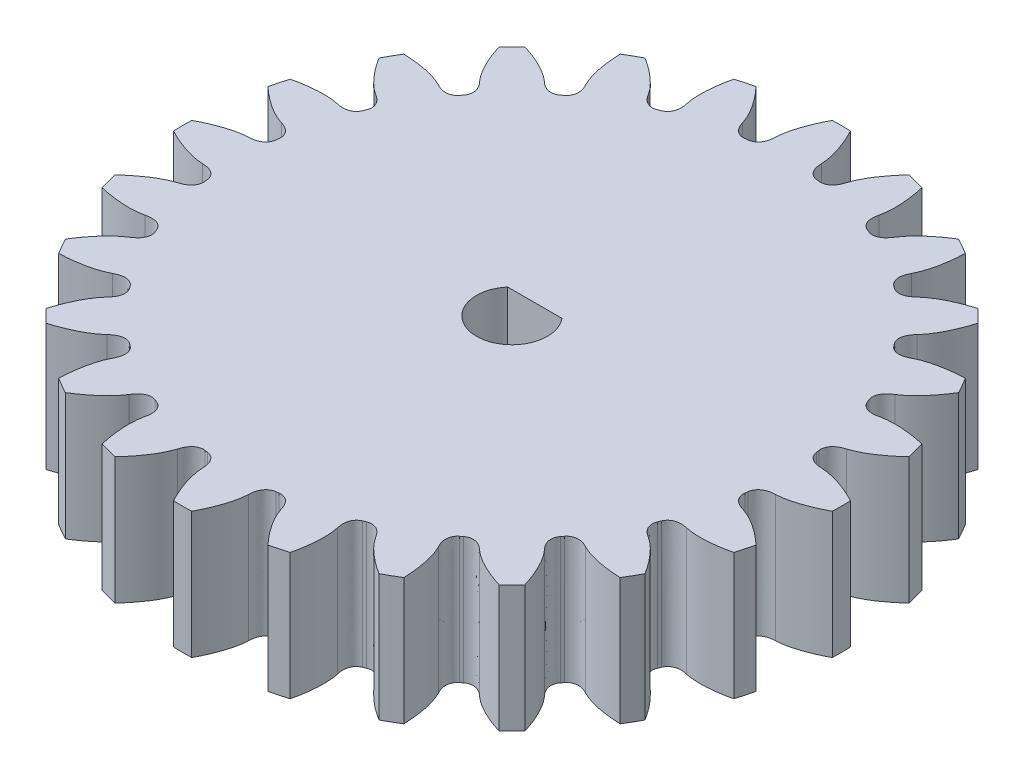
from build123d import *

# Parameters (mm, degrees)
EXTRUDE_1_DEPTH = 5


with BuildPart() as part:
    # Эскиз1 → Бобышка-Вытянуть1 (new body)
    with BuildSketch(Plane(origin=(0, 0, 0), x_dir=(1, 0, 0), z_dir=(0, 1, 0))):
        with BuildLine():
            ThreePointArc((0.357730054, 12.995077114), (0, 13), (-0.357730054, 12.995077114))
            add(Edge.make_bspline(
                [(-0.905776829, 11.30170004), (-0.903153797, 11.364174343), (-0.897985909, 11.426330365), (-0.890273167, 11.488168106), (-0.882433861, 11.551020594), (-0.871236283, 11.61359405), (-0.858868063, 11.675739131), (-0.846302347, 11.73887655), (-0.831417931, 11.801647657), (-0.815287884, 11.863979043), (-0.798904868, 11.927287976), (-0.780635548, 11.990183506), (-0.761176822, 12.052620709), (-0.741417879, 12.116021219), (-0.720022631, 12.178974672), (-0.697502256, 12.241450826), (-0.67463984, 12.304875873), (-0.650308122, 12.367826515), (-0.624909495, 12.430281414), (-0.599130965, 12.493670489), (-0.572004587, 12.556561325), (-0.543862193, 12.618938569), (-0.515305116, 12.682234954), (-0.485493692, 12.745011445), (-0.45471074, 12.807257013), (-0.423480821, 12.870406383), (-0.391153926, 12.933013083), (-0.357730054, 12.995077114)],
                knots=[0, 0, 0, 0, 1, 1, 1, 2, 2, 2, 3, 3, 3, 4, 4, 4, 5, 5, 5, 6, 6, 6, 7, 7, 7, 8, 8, 8, 9, 9, 9, 9], degree=3))
            add(Edge.make_bspline(
                [(-0.905776829, 11.30170004), (-0.905771657, 11.23039326), (-0.913828063, 11.160800255), (-0.929946047, 11.092921025), (-0.939606651, 11.052236386), (-0.951337627, 11.011263415), (-0.96761603, 10.972714088), (-0.979860318, 10.943718059), (-0.994015249, 10.915028809), (-1.010665897, 10.888305341), (-1.024787349, 10.865641106), (-1.040586182, 10.843617085), (-1.057994763, 10.823361181), (-1.073764387, 10.8050123), (-1.090989796, 10.787535026), (-1.10932187, 10.771741608), (-1.126572142, 10.756880182), (-1.145069758, 10.743071473), (-1.164321541, 10.730911074), (-1.182867326, 10.719196619), (-1.202457761, 10.708685073), (-1.222516171, 10.6998039), (-1.242144834, 10.691113003), (-1.262615206, 10.683752451), (-1.283298802, 10.67800565), (-1.303777222, 10.672315856), (-1.324670017, 10.668115352), (-1.345977185, 10.665404138)],
                knots=[0, 0, 0, 0, 1, 1, 1, 2, 2, 2, 3, 3, 3, 4, 4, 4, 5, 5, 5, 6, 6, 6, 7, 7, 7, 8, 8, 8, 9, 9, 9, 9], degree=3))
            ThreePointArc((-1.345977185, 10.665404138), (-1.403156566, 10.65803226), (-1.46029559, 10.650353834))
            add(Edge.make_bspline(
                [(-2.05018198, 11.151036243), (-2.031731423, 11.082157845), (-2.005937537, 11.017021315), (-1.972800323, 10.955626655), (-1.952938937, 10.91882866), (-1.931003099, 10.882288009), (-1.905302069, 10.849265379), (-1.88597027, 10.824426421), (-1.864872333, 10.800378299), (-1.8418725, 10.778874916), (-1.822366288, 10.760637847), (-1.801405552, 10.743453315), (-1.77934754, 10.728393287), (-1.759366213, 10.714751107), (-1.738204295, 10.702327621), (-1.716409234, 10.69181704), (-1.69590033, 10.681926704), (-1.674459048, 10.673376051), (-1.652715911, 10.666612735), (-1.631770134, 10.660097443), (-1.610126638, 10.655014447), (-1.588453086, 10.651627391), (-1.567243883, 10.648312902), (-1.545565971, 10.646501276), (-1.52409977, 10.646303601), (-1.502846508, 10.646107887), (-1.481578448, 10.647457965), (-1.46029559, 10.650353834)],
                knots=[0, 0, 0, 0, 1, 1, 1, 2, 2, 2, 3, 3, 3, 4, 4, 4, 5, 5, 5, 6, 6, 6, 7, 7, 7, 8, 8, 8, 9, 9, 9, 9], degree=3))
            add(Edge.make_bspline(
                [(-2.05018198, 11.151036243), (-2.068885174, 11.210702895), (-2.089964133, 11.269403455), (-2.113418854, 11.327137921), (-2.137258464, 11.385819801), (-2.164269696, 11.443362972), (-2.192300809, 11.50018938), (-2.220779525, 11.557923196), (-2.251403125, 11.614703059), (-2.283116104, 11.670735792), (-2.31532644, 11.727647289), (-2.349251809, 11.783671257), (-2.384207432, 11.838944675), (-2.419702365, 11.895070875), (-2.45666214, 11.950341743), (-2.494585171, 12.004860372), (-2.533084179, 12.060207035), (-2.572879639, 12.114715173), (-2.613577346, 12.168468325), (-2.654883793, 12.223025495), (-2.697363208, 12.276752555), (-2.740691092, 12.329720558), (-2.784657421, 12.383469055), (-2.829700796, 12.436390725), (-2.875545183, 12.488548112), (-2.922055228, 12.541462822), (-2.969484417, 12.593569434), (-3.017832751, 12.64486795)],
                knots=[0, 0, 0, 0, 1, 1, 1, 2, 2, 2, 3, 3, 3, 4, 4, 4, 5, 5, 5, 6, 6, 6, 7, 7, 7, 8, 8, 8, 9, 9, 9, 9], degree=3))
            ThreePointArc((-3.017832751, 12.64486795), (-3.364647586, 12.557035742), (-3.708914148, 12.459693248))
            add(Edge.make_bspline(
                [(-3.800008445, 10.682171655), (-3.813644329, 10.743196089), (-3.824739696, 10.804571744), (-3.833294544, 10.866298619), (-3.841989776, 10.929038422), (-3.847368949, 10.992377886), (-3.851506497, 11.055606556), (-3.855710113, 11.119844866), (-3.857579229, 11.184329469), (-3.85813135, 11.248711729), (-3.85869213, 11.314103698), (-3.857323882, 11.379584563), (-3.854688134, 11.444930559), (-3.85201172, 11.51128474), (-3.847639049, 11.577630603), (-3.842056056, 11.643806636), (-3.836388268, 11.710987756), (-3.829178458, 11.778090919), (-3.820809786, 11.844991368), (-3.812315939, 11.912892486), (-3.802391216, 11.980661192), (-3.791352169, 12.048196771), (-3.78015046, 12.116727499), (-3.767602588, 12.185080697), (-3.753978878, 12.253172513), (-3.740157352, 12.322253018), (-3.725135776, 12.391093263), (-3.708914148, 12.459693248)],
                knots=[0, 0, 0, 0, 1, 1, 1, 2, 2, 2, 3, 3, 3, 4, 4, 4, 5, 5, 5, 6, 6, 6, 7, 7, 7, 8, 8, 8, 9, 9, 9, 9], degree=3))
            add(Edge.make_bspline(
                [(-3.800008445, 10.682171655), (-3.781547896, 10.613295934), (-3.771317792, 10.543989102), (-3.769318131, 10.474251159), (-3.768119598, 10.432452467), (-3.768846266, 10.389839417), (-3.774592696, 10.348390465), (-3.778915046, 10.317213397), (-3.785162334, 10.285838144), (-3.794329082, 10.255715751), (-3.802103423, 10.23016888), (-3.811663687, 10.204806271), (-3.823236471, 10.180734898), (-3.833719719, 10.158929761), (-3.845834734, 10.137589747), (-3.859454521, 10.117589786), (-3.872270584, 10.098770052), (-3.886563952, 10.080644328), (-3.902012404, 10.063915557), (-3.916894333, 10.047800259), (-3.933096651, 10.032576508), (-3.95017297, 10.018806455), (-3.966883434, 10.005331422), (-3.984751244, 9.992923552), (-4.003242682, 9.98201926), (-4.02155069, 9.971223136), (-4.040644409, 9.961758307), (-4.060523839, 9.953624775)],
                knots=[0, 0, 0, 0, 1, 1, 1, 2, 2, 2, 3, 3, 3, 4, 4, 4, 5, 5, 5, 6, 6, 6, 7, 7, 7, 8, 8, 8, 9, 9, 9, 9], degree=3))
            ThreePointArc((-4.060523839, 9.953624775), (-4.113846898, 9.931704974), (-4.167051634, 9.909499517))
            add(Edge.make_bspline(
                [(-4.866424275, 10.240447755), (-4.830775365, 10.178691686), (-4.78900181, 10.122450579), (-4.741103611, 10.071724433), (-4.712394964, 10.041320804), (-4.681749155, 10.011702659), (-4.648376981, 9.986457164), (-4.623275101, 9.96746801), (-4.596671947, 9.949699856), (-4.568890329, 9.934881978), (-4.545328675, 9.922314901), (-4.520634474, 9.911140955), (-4.495430249, 9.902303119), (-4.472598913, 9.894297334), (-4.448942635, 9.887774275), (-4.425169884, 9.883262811), (-4.402799996, 9.879017574), (-4.379876237, 9.876307689), (-4.357123505, 9.875402366), (-4.335205155, 9.874530243), (-4.312983568, 9.875222195), (-4.29117189, 9.877560078), (-4.26982752, 9.879847873), (-4.248419382, 9.883708634), (-4.227633462, 9.889073556), (-4.207053733, 9.89438526), (-4.18685979, 9.901193914), (-4.167051634, 9.909499517)],
                knots=[0, 0, 0, 0, 1, 1, 1, 2, 2, 2, 3, 3, 3, 4, 4, 4, 5, 5, 5, 6, 6, 6, 7, 7, 7, 8, 8, 8, 9, 9, 9, 9], degree=3))
            add(Edge.make_bspline(
                [(-4.866424275, 10.240447755), (-4.89993304, 10.293240572), (-4.935486573, 10.344485323), (-4.973084874, 10.394182006), (-5.011300156, 10.444694204), (-5.052284271, 10.493285618), (-5.094068004, 10.540920727), (-5.136518943, 10.589316478), (-5.180794779, 10.636235643), (-5.225929503, 10.682151183), (-5.271772077, 10.72878682), (-5.319041538, 10.774121286), (-5.36711189, 10.818464127), (-5.415923891, 10.863491108), (-5.465929446, 10.907312773), (-5.51667074, 10.950158522), (-5.568182697, 10.993655017), (-5.620729904, 11.036006012), (-5.67395321, 11.077394228), (-5.727972608, 11.119401513), (-5.782910159, 11.160303386), (-5.838470809, 11.200252466), (-5.894850156, 11.240790204), (-5.952055852, 11.280250529), (-6.009837454, 11.318765296), (-6.068458042, 11.357839295), (-6.127757305, 11.39589484), (-6.187735242, 11.432931932)],
                knots=[0, 0, 0, 0, 1, 1, 1, 2, 2, 2, 3, 3, 3, 4, 4, 4, 5, 5, 5, 6, 6, 6, 7, 7, 7, 8, 8, 8, 9, 9, 9, 9], degree=3))
            ThreePointArc((-6.187735242, 11.432931932), (-6.5, 11.258330249), (-6.807341872, 11.075201878))
            add(Edge.make_bspline(
                [(-6.435275764, 9.334670926), (-6.464241303, 9.390086775), (-6.490843792, 9.446499413), (-6.515083232, 9.503908839), (-6.539720437, 9.562260343), (-6.561309779, 9.622049335), (-6.581671127, 9.682052664), (-6.602357607, 9.743014131), (-6.620852878, 9.804817712), (-6.63804954, 9.866863299), (-6.655515899, 9.929881951), (-6.671141968, 9.993485738), (-6.685508819, 10.057287305), (-6.700097328, 10.122073229), (-6.713045225, 10.187290142), (-6.724780086, 10.252656266), (-6.736693176, 10.319015177), (-6.747096611, 10.385697891), (-6.756328205, 10.452484734), (-6.765697881, 10.520270548), (-6.773651166, 10.588298798), (-6.78046776, 10.656390273), (-6.787384798, 10.725485089), (-6.792955594, 10.794756837), (-6.797419559, 10.864054556), (-6.801948341, 10.934358474), (-6.805255778, 11.004740914), (-6.807341872, 11.075201878)],
                knots=[0, 0, 0, 0, 1, 1, 1, 2, 2, 2, 3, 3, 3, 4, 4, 4, 5, 5, 5, 6, 6, 6, 7, 7, 7, 8, 8, 8, 9, 9, 9, 9], degree=3))
            add(Edge.make_bspline(
                [(-6.435275764, 9.334670926), (-6.399617895, 9.272920029), (-6.371798445, 9.208622516), (-6.351817413, 9.141778386), (-6.339841422, 9.101714154), (-6.32951426, 9.060365032), (-6.324337108, 9.018841134), (-6.320442957, 8.987607692), (-6.318356862, 8.955684607), (-6.319415012, 8.924216081), (-6.320312431, 8.897527551), (-6.322982611, 8.870554774), (-6.327930932, 8.844308356), (-6.332413387, 8.820532946), (-6.338592391, 8.796784479), (-6.346571724, 8.773940941), (-6.354080185, 8.752445432), (-6.363195236, 8.731237931), (-6.373787569, 8.711080826), (-6.383991463, 8.691662917), (-6.395701505, 8.672764433), (-6.40863201, 8.655043907), (-6.421285484, 8.637703038), (-6.435333069, 8.621093427), (-6.450372188, 8.605774754), (-6.465262123, 8.590608037), (-6.481255562, 8.576523897), (-6.498352504, 8.563522332)],
                knots=[0, 0, 0, 0, 1, 1, 1, 2, 2, 2, 3, 3, 3, 4, 4, 4, 5, 5, 5, 6, 6, 6, 7, 7, 7, 8, 8, 8, 9, 9, 9, 9], degree=3))
            ThreePointArc((-6.498352504, 8.563522332), (-6.544185362, 8.528548408), (-6.589829995, 8.493329185))
            add(Edge.make_bspline(
                [(-7.351027799, 8.631989675), (-7.300609948, 8.581564511), (-7.245703523, 8.538051564), (-7.186308524, 8.501450836), (-7.150709061, 8.47951353), (-7.113441743, 8.458836318), (-7.074672683, 8.443088397), (-7.045511375, 8.431243127), (-7.015215964, 8.420965811), (-6.984545833, 8.413843251), (-6.958534424, 8.407802592), (-6.931789628, 8.403400719), (-6.905156815, 8.401387358), (-6.881031389, 8.399563548), (-6.856492887, 8.399385452), (-6.83236252, 8.401180553), (-6.80965612, 8.402869722), (-6.786812099, 8.40618528), (-6.764600332, 8.411199646), (-6.74320311, 8.416030126), (-6.721917795, 8.42244987), (-6.701454421, 8.430353369), (-6.681429467, 8.438087539), (-6.661750033, 8.447357581), (-6.64306092, 8.45791949), (-6.624557198, 8.468376628), (-6.606813556, 8.480179859), (-6.589829995, 8.493329185)],
                knots=[0, 0, 0, 0, 1, 1, 1, 2, 2, 2, 3, 3, 3, 4, 4, 4, 5, 5, 5, 6, 6, 6, 7, 7, 7, 8, 8, 8, 9, 9, 9, 9], degree=3))
            add(Edge.make_bspline(
                [(-7.351027799, 8.631989675), (-7.397058566, 8.674310914), (-7.444663759, 8.714607611), (-7.493843377, 8.752879765), (-7.543830025, 8.791779958), (-7.595994023, 8.828108191), (-7.648682883, 8.863305747), (-7.702213083, 8.89906534), (-7.75712383, 8.932926344), (-7.812604442, 8.965595625), (-7.868955159, 8.998777259), (-7.926347375, 9.030332754), (-7.984256542, 9.060723127), (-8.043059155, 9.091582375), (-8.102702693, 9.120968463), (-8.162804316, 9.149221466), (-8.223818766, 9.177903577), (-8.285536715, 9.20521128), (-8.347658539, 9.231414022), (-8.410709557, 9.258008693), (-8.474361339, 9.283297984), (-8.538368389, 9.307505679), (-8.603318594, 9.332070078), (-8.668788137, 9.355379901), (-8.734569235, 9.37762733), (-8.801305469, 9.40019779), (-8.868433658, 9.421608846), (-8.935953802, 9.441860497)],
                knots=[0, 0, 0, 0, 1, 1, 1, 2, 2, 2, 3, 3, 3, 4, 4, 4, 5, 5, 5, 6, 6, 6, 7, 7, 7, 8, 8, 8, 9, 9, 9, 9], degree=3))
            ThreePointArc((-8.935953802, 9.441860497), (-9.192388155, 9.192388155), (-9.441860497, 8.935953802))
            add(Edge.make_bspline(
                [(-8.631989675, 7.351027799), (-8.674310914, 7.397058566), (-8.714607611, 7.444663759), (-8.752879765, 7.493843377), (-8.791779958, 7.543830025), (-8.828108191, 7.595994023), (-8.863305747, 7.648682883), (-8.89906534, 7.702213083), (-8.932926344, 7.75712383), (-8.965595625, 7.812604442), (-8.998777259, 7.868955159), (-9.030332754, 7.926347375), (-9.060723127, 7.984256542), (-9.091582375, 8.043059155), (-9.120968463, 8.102702693), (-9.149221466, 8.162804316), (-9.177903577, 8.223818766), (-9.20521128, 8.285536715), (-9.231414022, 8.347658539), (-9.258008693, 8.410709557), (-9.283297984, 8.474361339), (-9.307505679, 8.538368389), (-9.332070078, 8.603318594), (-9.355379901, 8.668788137), (-9.37762733, 8.734569235), (-9.40019779, 8.801305469), (-9.421608846, 8.868433658), (-9.441860497, 8.935953802)],
                knots=[0, 0, 0, 0, 1, 1, 1, 2, 2, 2, 3, 3, 3, 4, 4, 4, 5, 5, 5, 6, 6, 6, 7, 7, 7, 8, 8, 8, 9, 9, 9, 9], degree=3))
            add(Edge.make_bspline(
                [(-8.631989675, 7.351027799), (-8.581564511, 7.300609948), (-8.538051564, 7.245703523), (-8.501450836, 7.186308524), (-8.47951353, 7.150709061), (-8.458836318, 7.113441743), (-8.443088397, 7.074672683), (-8.431243127, 7.045511375), (-8.420965811, 7.015215964), (-8.413843251, 6.984545833), (-8.407802592, 6.958534424), (-8.403400719, 6.931789628), (-8.401387358, 6.905156815), (-8.399563548, 6.881031389), (-8.399385452, 6.856492887), (-8.401180553, 6.83236252), (-8.402869722, 6.80965612), (-8.40618528, 6.786812099), (-8.411199646, 6.764600332), (-8.416030126, 6.74320311), (-8.42244987, 6.721917795), (-8.430353369, 6.701454421), (-8.438087539, 6.681429467), (-8.447357581, 6.661750033), (-8.45791949, 6.64306092), (-8.468376628, 6.624557198), (-8.480179859, 6.606813556), (-8.493329185, 6.589829995)],
                knots=[0, 0, 0, 0, 1, 1, 1, 2, 2, 2, 3, 3, 3, 4, 4, 4, 5, 5, 5, 6, 6, 6, 7, 7, 7, 8, 8, 8, 9, 9, 9, 9], degree=3))
            ThreePointArc((-8.493329185, 6.589829995), (-8.528548408, 6.544185362), (-8.563522332, 6.498352504))
            add(Edge.make_bspline(
                [(-9.334670926, 6.435275764), (-9.272920029, 6.399617895), (-9.208622516, 6.371798445), (-9.141778386, 6.351817413), (-9.101714154, 6.339841422), (-9.060365032, 6.32951426), (-9.018841134, 6.324337108), (-8.987607692, 6.320442957), (-8.955684607, 6.318356862), (-8.924216081, 6.319415012), (-8.897527551, 6.320312431), (-8.870554774, 6.322982611), (-8.844308356, 6.327930932), (-8.820532946, 6.332413387), (-8.796784479, 6.338592391), (-8.773940941, 6.346571724), (-8.752445432, 6.354080185), (-8.731237931, 6.363195236), (-8.711080826, 6.373787569), (-8.691662917, 6.383991463), (-8.672764433, 6.395701505), (-8.655043907, 6.40863201), (-8.637703038, 6.421285484), (-8.621093427, 6.435333069), (-8.605774754, 6.450372188), (-8.590608037, 6.465262123), (-8.576523897, 6.481255562), (-8.563522332, 6.498352504)],
                knots=[0, 0, 0, 0, 1, 1, 1, 2, 2, 2, 3, 3, 3, 4, 4, 4, 5, 5, 5, 6, 6, 6, 7, 7, 7, 8, 8, 8, 9, 9, 9, 9], degree=3))
            add(Edge.make_bspline(
                [(-9.334670926, 6.435275764), (-9.390086775, 6.464241303), (-9.446499413, 6.490843792), (-9.503908839, 6.515083232), (-9.562260343, 6.539720437), (-9.622049335, 6.561309779), (-9.682052664, 6.581671127), (-9.743014131, 6.602357607), (-9.804817712, 6.620852878), (-9.866863299, 6.63804954), (-9.929881951, 6.655515899), (-9.993485738, 6.671141968), (-10.057287305, 6.685508819), (-10.122073229, 6.700097328), (-10.187290142, 6.713045225), (-10.252656266, 6.724780086), (-10.319015177, 6.736693176), (-10.385697891, 6.747096611), (-10.452484734, 6.756328205), (-10.520270548, 6.765697881), (-10.588298798, 6.773651166), (-10.656390273, 6.78046776), (-10.725485089, 6.787384798), (-10.794756837, 6.792955594), (-10.864054556, 6.797419559), (-10.934358474, 6.801948341), (-11.004740914, 6.805255778), (-11.075201878, 6.807341872)],
                knots=[0, 0, 0, 0, 1, 1, 1, 2, 2, 2, 3, 3, 3, 4, 4, 4, 5, 5, 5, 6, 6, 6, 7, 7, 7, 8, 8, 8, 9, 9, 9, 9], degree=3))
            ThreePointArc((-11.075201878, 6.807341872), (-11.258330249, 6.5), (-11.432931932, 6.187735242))
            add(Edge.make_bspline(
                [(-10.240447755, 4.866424275), (-10.293240572, 4.89993304), (-10.344485323, 4.935486573), (-10.394182006, 4.973084874), (-10.444694204, 5.011300156), (-10.493285618, 5.052284271), (-10.540920727, 5.094068004), (-10.589316478, 5.136518943), (-10.636235643, 5.180794779), (-10.682151183, 5.225929503), (-10.72878682, 5.271772077), (-10.774121286, 5.319041538), (-10.818464127, 5.36711189), (-10.863491108, 5.415923891), (-10.907312773, 5.465929446), (-10.950158522, 5.51667074), (-10.993655017, 5.568182697), (-11.036006012, 5.620729904), (-11.077394228, 5.67395321), (-11.119401513, 5.727972608), (-11.160303386, 5.782910159), (-11.200252466, 5.838470809), (-11.240790204, 5.894850156), (-11.280250529, 5.952055852), (-11.318765296, 6.009837454), (-11.357839295, 6.068458042), (-11.39589484, 6.127757305), (-11.432931932, 6.187735242)],
                knots=[0, 0, 0, 0, 1, 1, 1, 2, 2, 2, 3, 3, 3, 4, 4, 4, 5, 5, 5, 6, 6, 6, 7, 7, 7, 8, 8, 8, 9, 9, 9, 9], degree=3))
            add(Edge.make_bspline(
                [(-10.240447755, 4.866424275), (-10.178691686, 4.830775365), (-10.122450579, 4.78900181), (-10.071724433, 4.741103611), (-10.041320804, 4.712394964), (-10.011702659, 4.681749155), (-9.986457164, 4.648376981), (-9.96746801, 4.623275101), (-9.949699856, 4.596671947), (-9.934881978, 4.568890329), (-9.922314901, 4.545328675), (-9.911140955, 4.520634474), (-9.902303119, 4.495430249), (-9.894297334, 4.472598913), (-9.887774275, 4.448942635), (-9.883262811, 4.425169884), (-9.879017574, 4.402799996), (-9.876307689, 4.379876237), (-9.875402366, 4.357123505), (-9.874530243, 4.335205155), (-9.875222195, 4.312983568), (-9.877560078, 4.29117189), (-9.879847873, 4.26982752), (-9.883708634, 4.248419382), (-9.889073556, 4.227633462), (-9.89438526, 4.207053733), (-9.901193914, 4.18685979), (-9.909499517, 4.167051634)],
                knots=[0, 0, 0, 0, 1, 1, 1, 2, 2, 2, 3, 3, 3, 4, 4, 4, 5, 5, 5, 6, 6, 6, 7, 7, 7, 8, 8, 8, 9, 9, 9, 9], degree=3))
            ThreePointArc((-9.909499517, 4.167051634), (-9.931704974, 4.113846898), (-9.953624775, 4.060523839))
            add(Edge.make_bspline(
                [(-10.682171655, 3.800008445), (-10.613295934, 3.781547896), (-10.543989102, 3.771317792), (-10.474251159, 3.769318131), (-10.432452467, 3.768119598), (-10.389839417, 3.768846266), (-10.348390465, 3.774592696), (-10.317213397, 3.778915046), (-10.285838144, 3.785162334), (-10.255715751, 3.794329082), (-10.23016888, 3.802103423), (-10.204806271, 3.811663687), (-10.180734898, 3.823236471), (-10.158929761, 3.833719719), (-10.137589747, 3.845834734), (-10.117589786, 3.859454521), (-10.098770052, 3.872270584), (-10.080644328, 3.886563952), (-10.063915557, 3.902012404), (-10.047800259, 3.916894333), (-10.032576508, 3.933096651), (-10.018806455, 3.95017297), (-10.005331422, 3.966883434), (-9.992923552, 3.984751244), (-9.98201926, 4.003242682), (-9.971223136, 4.02155069), (-9.961758307, 4.040644409), (-9.953624775, 4.060523839)],
                knots=[0, 0, 0, 0, 1, 1, 1, 2, 2, 2, 3, 3, 3, 4, 4, 4, 5, 5, 5, 6, 6, 6, 7, 7, 7, 8, 8, 8, 9, 9, 9, 9], degree=3))
            add(Edge.make_bspline(
                [(-10.682171655, 3.800008445), (-10.743196089, 3.813644329), (-10.804571744, 3.824739696), (-10.866298619, 3.833294544), (-10.929038422, 3.841989776), (-10.992377886, 3.847368949), (-11.055606556, 3.851506497), (-11.119844866, 3.855710113), (-11.184329469, 3.857579229), (-11.248711729, 3.85813135), (-11.314103698, 3.85869213), (-11.379584563, 3.857323882), (-11.444930559, 3.854688134), (-11.51128474, 3.85201172), (-11.577630603, 3.847639049), (-11.643806636, 3.842056056), (-11.710987756, 3.836388268), (-11.778090919, 3.829178458), (-11.844991368, 3.820809786), (-11.912892486, 3.812315939), (-11.980661192, 3.802391216), (-12.048196771, 3.791352169), (-12.116727499, 3.78015046), (-12.185080697, 3.767602588), (-12.253172513, 3.753978878), (-12.322253018, 3.740157352), (-12.391093263, 3.725135776), (-12.459693248, 3.708914148)],
                knots=[0, 0, 0, 0, 1, 1, 1, 2, 2, 2, 3, 3, 3, 4, 4, 4, 5, 5, 5, 6, 6, 6, 7, 7, 7, 8, 8, 8, 9, 9, 9, 9], degree=3))
            ThreePointArc((-12.459693248, 3.708914148), (-12.557035742, 3.364647586), (-12.64486795, 3.017832751))
            add(Edge.make_bspline(
                [(-11.151036243, 2.05018198), (-11.210702895, 2.068885174), (-11.269403455, 2.089964133), (-11.327137921, 2.113418854), (-11.385819801, 2.137258464), (-11.443362972, 2.164269696), (-11.50018938, 2.192300809), (-11.557923196, 2.220779525), (-11.614703059, 2.251403125), (-11.670735792, 2.283116104), (-11.727647289, 2.31532644), (-11.783671257, 2.349251809), (-11.838944675, 2.384207432), (-11.895070875, 2.419702365), (-11.950341743, 2.45666214), (-12.004860372, 2.494585171), (-12.060207035, 2.533084179), (-12.114715173, 2.572879639), (-12.168468325, 2.613577346), (-12.223025495, 2.654883793), (-12.276752555, 2.697363208), (-12.329720558, 2.740691092), (-12.383469055, 2.784657421), (-12.436390725, 2.829700796), (-12.488548112, 2.875545183), (-12.541462822, 2.922055228), (-12.593569434, 2.969484417), (-12.64486795, 3.017832751)],
                knots=[0, 0, 0, 0, 1, 1, 1, 2, 2, 2, 3, 3, 3, 4, 4, 4, 5, 5, 5, 6, 6, 6, 7, 7, 7, 8, 8, 8, 9, 9, 9, 9], degree=3))
            add(Edge.make_bspline(
                [(-11.151036243, 2.05018198), (-11.082157845, 2.031731423), (-11.017021315, 2.005937537), (-10.955626655, 1.972800323), (-10.91882866, 1.952938937), (-10.882288009, 1.931003099), (-10.849265379, 1.905302069), (-10.824426421, 1.88597027), (-10.800378299, 1.864872333), (-10.778874916, 1.8418725), (-10.760637847, 1.822366288), (-10.743453315, 1.801405552), (-10.728393287, 1.77934754), (-10.714751107, 1.759366213), (-10.702327621, 1.738204295), (-10.69181704, 1.716409234), (-10.681926704, 1.69590033), (-10.673376051, 1.674459048), (-10.666612735, 1.652715911), (-10.660097443, 1.631770134), (-10.655014447, 1.610126638), (-10.651627391, 1.588453086), (-10.648312902, 1.567243883), (-10.646501276, 1.545565971), (-10.646303601, 1.52409977), (-10.646107887, 1.502846508), (-10.647457965, 1.481578448), (-10.650353834, 1.46029559)],
                knots=[0, 0, 0, 0, 1, 1, 1, 2, 2, 2, 3, 3, 3, 4, 4, 4, 5, 5, 5, 6, 6, 6, 7, 7, 7, 8, 8, 8, 9, 9, 9, 9], degree=3))
            ThreePointArc((-10.650353834, 1.46029559), (-10.65803226, 1.403156566), (-10.665404138, 1.345977185))
            add(Edge.make_bspline(
                [(-11.30170004, 0.905776829), (-11.23039326, 0.905771657), (-11.160800255, 0.913828063), (-11.092921025, 0.929946047), (-11.052236386, 0.939606651), (-11.011263415, 0.951337627), (-10.972714088, 0.96761603), (-10.943718059, 0.979860318), (-10.915028809, 0.994015249), (-10.888305341, 1.010665897), (-10.865641106, 1.024787349), (-10.843617085, 1.040586182), (-10.823361181, 1.057994763), (-10.8050123, 1.073764387), (-10.787535026, 1.090989796), (-10.771741608, 1.10932187), (-10.756880182, 1.126572142), (-10.743071473, 1.145069758), (-10.730911074, 1.164321541), (-10.719196619, 1.182867326), (-10.708685073, 1.202457761), (-10.6998039, 1.222516171), (-10.691113003, 1.242144834), (-10.683752451, 1.262615206), (-10.67800565, 1.283298802), (-10.672315856, 1.303777222), (-10.668115352, 1.324670017), (-10.665404138, 1.345977185)],
                knots=[0, 0, 0, 0, 1, 1, 1, 2, 2, 2, 3, 3, 3, 4, 4, 4, 5, 5, 5, 6, 6, 6, 7, 7, 7, 8, 8, 8, 9, 9, 9, 9], degree=3))
            add(Edge.make_bspline(
                [(-11.30170004, 0.905776829), (-11.364174343, 0.903153797), (-11.426330365, 0.897985909), (-11.488168106, 0.890273167), (-11.551020594, 0.882433861), (-11.61359405, 0.871236283), (-11.675739131, 0.858868063), (-11.73887655, 0.846302347), (-11.801647657, 0.831417931), (-11.863979043, 0.815287884), (-11.927287976, 0.798904868), (-11.990183506, 0.780635548), (-12.052620709, 0.761176822), (-12.116021219, 0.741417879), (-12.178974672, 0.720022631), (-12.241450826, 0.697502256), (-12.304875873, 0.67463984), (-12.367826515, 0.650308122), (-12.430281414, 0.624909495), (-12.493670489, 0.599130965), (-12.556561325, 0.572004587), (-12.618938569, 0.543862193), (-12.682234954, 0.515305116), (-12.745011445, 0.485493692), (-12.807257013, 0.45471074), (-12.870406383, 0.423480821), (-12.933013083, 0.391153926), (-12.995077114, 0.357730054)],
                knots=[0, 0, 0, 0, 1, 1, 1, 2, 2, 2, 3, 3, 3, 4, 4, 4, 5, 5, 5, 6, 6, 6, 7, 7, 7, 8, 8, 8, 9, 9, 9, 9], degree=3))
            ThreePointArc((-12.995077114, 0.357730054), (-13, 0), (-12.995077114, -0.357730054))
            add(Edge.make_bspline(
                [(-11.30170004, -0.905776829), (-11.364174343, -0.903153797), (-11.426330365, -0.897985909), (-11.488168106, -0.890273167), (-11.551020594, -0.882433861), (-11.61359405, -0.871236283), (-11.675739131, -0.858868063), (-11.73887655, -0.846302347), (-11.801647657, -0.831417931), (-11.863979043, -0.815287884), (-11.927287976, -0.798904868), (-11.990183506, -0.780635548), (-12.052620709, -0.761176822), (-12.116021219, -0.741417879), (-12.178974672, -0.720022631), (-12.241450826, -0.697502256), (-12.304875873, -0.67463984), (-12.367826515, -0.650308122), (-12.430281414, -0.624909495), (-12.493670489, -0.599130965), (-12.556561325, -0.572004587), (-12.618938569, -0.543862193), (-12.682234954, -0.515305116), (-12.745011445, -0.485493692), (-12.807257013, -0.45471074), (-12.870406383, -0.423480821), (-12.933013083, -0.391153926), (-12.995077114, -0.357730054)],
                knots=[0, 0, 0, 0, 1, 1, 1, 2, 2, 2, 3, 3, 3, 4, 4, 4, 5, 5, 5, 6, 6, 6, 7, 7, 7, 8, 8, 8, 9, 9, 9, 9], degree=3))
            add(Edge.make_bspline(
                [(-11.30170004, -0.905776829), (-11.23039326, -0.905771657), (-11.160800255, -0.913828063), (-11.092921025, -0.929946047), (-11.052236386, -0.939606651), (-11.011263415, -0.951337627), (-10.972714088, -0.96761603), (-10.943718059, -0.979860318), (-10.915028809, -0.994015249), (-10.888305341, -1.010665897), (-10.865641106, -1.024787349), (-10.843617085, -1.040586182), (-10.823361181, -1.057994763), (-10.8050123, -1.073764387), (-10.787535026, -1.090989796), (-10.771741608, -1.10932187), (-10.756880182, -1.126572142), (-10.743071473, -1.145069758), (-10.730911074, -1.164321541), (-10.719196619, -1.182867326), (-10.708685073, -1.202457761), (-10.6998039, -1.222516171), (-10.691113003, -1.242144834), (-10.683752451, -1.262615206), (-10.67800565, -1.283298802), (-10.672315856, -1.303777222), (-10.668115352, -1.324670017), (-10.665404138, -1.345977185)],
                knots=[0, 0, 0, 0, 1, 1, 1, 2, 2, 2, 3, 3, 3, 4, 4, 4, 5, 5, 5, 6, 6, 6, 7, 7, 7, 8, 8, 8, 9, 9, 9, 9], degree=3))
            ThreePointArc((-10.665404138, -1.345977185), (-10.65803226, -1.403156566), (-10.650353834, -1.46029559))
            add(Edge.make_bspline(
                [(-11.151036243, -2.05018198), (-11.082157845, -2.031731423), (-11.017021315, -2.005937537), (-10.955626655, -1.972800323), (-10.91882866, -1.952938937), (-10.882288009, -1.931003099), (-10.849265379, -1.905302069), (-10.824426421, -1.88597027), (-10.800378299, -1.864872333), (-10.778874916, -1.8418725), (-10.760637847, -1.822366288), (-10.743453315, -1.801405552), (-10.728393287, -1.77934754), (-10.714751107, -1.759366213), (-10.702327621, -1.738204295), (-10.69181704, -1.716409234), (-10.681926704, -1.69590033), (-10.673376051, -1.674459048), (-10.666612735, -1.652715911), (-10.660097443, -1.631770134), (-10.655014447, -1.610126638), (-10.651627391, -1.588453086), (-10.648312902, -1.567243883), (-10.646501276, -1.545565971), (-10.646303601, -1.52409977), (-10.646107887, -1.502846508), (-10.647457965, -1.481578448), (-10.650353834, -1.46029559)],
                knots=[0, 0, 0, 0, 1, 1, 1, 2, 2, 2, 3, 3, 3, 4, 4, 4, 5, 5, 5, 6, 6, 6, 7, 7, 7, 8, 8, 8, 9, 9, 9, 9], degree=3))
            add(Edge.make_bspline(
                [(-11.151036243, -2.05018198), (-11.210702895, -2.068885174), (-11.269403455, -2.089964133), (-11.327137921, -2.113418854), (-11.385819801, -2.137258464), (-11.443362972, -2.164269696), (-11.50018938, -2.192300809), (-11.557923196, -2.220779525), (-11.614703059, -2.251403125), (-11.670735792, -2.283116104), (-11.727647289, -2.31532644), (-11.783671257, -2.349251809), (-11.838944675, -2.384207432), (-11.895070875, -2.419702365), (-11.950341743, -2.45666214), (-12.004860372, -2.494585171), (-12.060207035, -2.533084179), (-12.114715173, -2.572879639), (-12.168468325, -2.613577346), (-12.223025495, -2.654883793), (-12.276752555, -2.697363208), (-12.329720558, -2.740691092), (-12.383469055, -2.784657421), (-12.436390725, -2.829700796), (-12.488548112, -2.875545183), (-12.541462822, -2.922055228), (-12.593569434, -2.969484417), (-12.64486795, -3.017832751)],
                knots=[0, 0, 0, 0, 1, 1, 1, 2, 2, 2, 3, 3, 3, 4, 4, 4, 5, 5, 5, 6, 6, 6, 7, 7, 7, 8, 8, 8, 9, 9, 9, 9], degree=3))
            ThreePointArc((-12.64486795, -3.017832751), (-12.557035742, -3.364647586), (-12.459693248, -3.708914148))
            add(Edge.make_bspline(
                [(-10.682171655, -3.800008445), (-10.743196089, -3.813644329), (-10.804571744, -3.824739696), (-10.866298619, -3.833294544), (-10.929038422, -3.841989776), (-10.992377886, -3.847368949), (-11.055606556, -3.851506497), (-11.119844866, -3.855710113), (-11.184329469, -3.857579229), (-11.248711729, -3.85813135), (-11.314103698, -3.85869213), (-11.379584563, -3.857323882), (-11.444930559, -3.854688134), (-11.51128474, -3.85201172), (-11.577630603, -3.847639049), (-11.643806636, -3.842056056), (-11.710987756, -3.836388268), (-11.778090919, -3.829178458), (-11.844991368, -3.820809786), (-11.912892486, -3.812315939), (-11.980661192, -3.802391216), (-12.048196771, -3.791352169), (-12.116727499, -3.78015046), (-12.185080697, -3.767602588), (-12.253172513, -3.753978878), (-12.322253018, -3.740157352), (-12.391093263, -3.725135776), (-12.459693248, -3.708914148)],
                knots=[0, 0, 0, 0, 1, 1, 1, 2, 2, 2, 3, 3, 3, 4, 4, 4, 5, 5, 5, 6, 6, 6, 7, 7, 7, 8, 8, 8, 9, 9, 9, 9], degree=3))
            add(Edge.make_bspline(
                [(-10.682171655, -3.800008445), (-10.613295934, -3.781547896), (-10.543989102, -3.771317792), (-10.474251159, -3.769318131), (-10.432452467, -3.768119598), (-10.389839417, -3.768846266), (-10.348390465, -3.774592696), (-10.317213397, -3.778915046), (-10.285838144, -3.785162334), (-10.255715751, -3.794329082), (-10.23016888, -3.802103423), (-10.204806271, -3.811663687), (-10.180734898, -3.823236471), (-10.158929761, -3.833719719), (-10.137589747, -3.845834734), (-10.117589786, -3.859454521), (-10.098770052, -3.872270584), (-10.080644328, -3.886563952), (-10.063915557, -3.902012404), (-10.047800259, -3.916894333), (-10.032576508, -3.933096651), (-10.018806455, -3.95017297), (-10.005331422, -3.966883434), (-9.992923552, -3.984751244), (-9.98201926, -4.003242682), (-9.971223136, -4.02155069), (-9.961758307, -4.040644409), (-9.953624775, -4.060523839)],
                knots=[0, 0, 0, 0, 1, 1, 1, 2, 2, 2, 3, 3, 3, 4, 4, 4, 5, 5, 5, 6, 6, 6, 7, 7, 7, 8, 8, 8, 9, 9, 9, 9], degree=3))
            ThreePointArc((-9.953624775, -4.060523839), (-9.931704974, -4.113846898), (-9.909499517, -4.167051634))
            add(Edge.make_bspline(
                [(-10.240447755, -4.866424275), (-10.178691686, -4.830775365), (-10.122450579, -4.78900181), (-10.071724433, -4.741103611), (-10.041320804, -4.712394964), (-10.011702659, -4.681749155), (-9.986457164, -4.648376981), (-9.96746801, -4.623275101), (-9.949699856, -4.596671947), (-9.934881978, -4.568890329), (-9.922314901, -4.545328675), (-9.911140955, -4.520634474), (-9.902303119, -4.495430249), (-9.894297334, -4.472598913), (-9.887774275, -4.448942635), (-9.883262811, -4.425169884), (-9.879017574, -4.402799996), (-9.876307689, -4.379876237), (-9.875402366, -4.357123505), (-9.874530243, -4.335205155), (-9.875222195, -4.312983568), (-9.877560078, -4.29117189), (-9.879847873, -4.26982752), (-9.883708634, -4.248419382), (-9.889073556, -4.227633462), (-9.89438526, -4.207053733), (-9.901193914, -4.18685979), (-9.909499517, -4.167051634)],
                knots=[0, 0, 0, 0, 1, 1, 1, 2, 2, 2, 3, 3, 3, 4, 4, 4, 5, 5, 5, 6, 6, 6, 7, 7, 7, 8, 8, 8, 9, 9, 9, 9], degree=3))
            add(Edge.make_bspline(
                [(-10.240447755, -4.866424275), (-10.293240572, -4.89993304), (-10.344485323, -4.935486573), (-10.394182006, -4.973084874), (-10.444694204, -5.011300156), (-10.493285618, -5.052284271), (-10.540920727, -5.094068004), (-10.589316478, -5.136518943), (-10.636235643, -5.180794779), (-10.682151183, -5.225929503), (-10.72878682, -5.271772077), (-10.774121286, -5.319041538), (-10.818464127, -5.36711189), (-10.863491108, -5.415923891), (-10.907312773, -5.465929446), (-10.950158522, -5.51667074), (-10.993655017, -5.568182697), (-11.036006012, -5.620729904), (-11.077394228, -5.67395321), (-11.119401513, -5.727972608), (-11.160303386, -5.782910159), (-11.200252466, -5.838470809), (-11.240790204, -5.894850156), (-11.280250529, -5.952055852), (-11.318765296, -6.009837454), (-11.357839295, -6.068458042), (-11.39589484, -6.127757305), (-11.432931932, -6.187735242)],
                knots=[0, 0, 0, 0, 1, 1, 1, 2, 2, 2, 3, 3, 3, 4, 4, 4, 5, 5, 5, 6, 6, 6, 7, 7, 7, 8, 8, 8, 9, 9, 9, 9], degree=3))
            ThreePointArc((-11.432931932, -6.187735242), (-11.258330249, -6.5), (-11.075201878, -6.807341872))
            add(Edge.make_bspline(
                [(-9.334670926, -6.435275764), (-9.390086775, -6.464241303), (-9.446499413, -6.490843792), (-9.503908839, -6.515083232), (-9.562260343, -6.539720437), (-9.622049335, -6.561309779), (-9.682052664, -6.581671127), (-9.743014131, -6.602357607), (-9.804817712, -6.620852878), (-9.866863299, -6.63804954), (-9.929881951, -6.655515899), (-9.993485738, -6.671141968), (-10.057287305, -6.685508819), (-10.122073229, -6.700097328), (-10.187290142, -6.713045225), (-10.252656266, -6.724780086), (-10.319015177, -6.736693176), (-10.385697891, -6.747096611), (-10.452484734, -6.756328205), (-10.520270548, -6.765697881), (-10.588298798, -6.773651166), (-10.656390273, -6.78046776), (-10.725485089, -6.787384798), (-10.794756837, -6.792955594), (-10.864054556, -6.797419559), (-10.934358474, -6.801948341), (-11.004740914, -6.805255778), (-11.075201878, -6.807341872)],
                knots=[0, 0, 0, 0, 1, 1, 1, 2, 2, 2, 3, 3, 3, 4, 4, 4, 5, 5, 5, 6, 6, 6, 7, 7, 7, 8, 8, 8, 9, 9, 9, 9], degree=3))
            add(Edge.make_bspline(
                [(-9.334670926, -6.435275764), (-9.272920029, -6.399617895), (-9.208622516, -6.371798445), (-9.141778386, -6.351817413), (-9.101714154, -6.339841422), (-9.060365032, -6.32951426), (-9.018841134, -6.324337108), (-8.987607692, -6.320442957), (-8.955684607, -6.318356862), (-8.924216081, -6.319415012), (-8.897527551, -6.320312431), (-8.870554774, -6.322982611), (-8.844308356, -6.327930932), (-8.820532946, -6.332413387), (-8.796784479, -6.338592391), (-8.773940941, -6.346571724), (-8.752445432, -6.354080185), (-8.731237931, -6.363195236), (-8.711080826, -6.373787569), (-8.691662917, -6.383991463), (-8.672764433, -6.395701505), (-8.655043907, -6.40863201), (-8.637703038, -6.421285484), (-8.621093427, -6.435333069), (-8.605774754, -6.450372188), (-8.590608037, -6.465262123), (-8.576523897, -6.481255562), (-8.563522332, -6.498352504)],
                knots=[0, 0, 0, 0, 1, 1, 1, 2, 2, 2, 3, 3, 3, 4, 4, 4, 5, 5, 5, 6, 6, 6, 7, 7, 7, 8, 8, 8, 9, 9, 9, 9], degree=3))
            ThreePointArc((-8.563522332, -6.498352504), (-8.528548408, -6.544185362), (-8.493329185, -6.589829995))
            add(Edge.make_bspline(
                [(-8.631989675, -7.351027799), (-8.581564511, -7.300609948), (-8.538051564, -7.245703523), (-8.501450836, -7.186308524), (-8.47951353, -7.150709061), (-8.458836318, -7.113441743), (-8.443088397, -7.074672683), (-8.431243127, -7.045511375), (-8.420965811, -7.015215964), (-8.413843251, -6.984545833), (-8.407802592, -6.958534424), (-8.403400719, -6.931789628), (-8.401387358, -6.905156815), (-8.399563548, -6.881031389), (-8.399385452, -6.856492887), (-8.401180553, -6.83236252), (-8.402869722, -6.80965612), (-8.40618528, -6.786812099), (-8.411199646, -6.764600332), (-8.416030126, -6.74320311), (-8.42244987, -6.721917795), (-8.430353369, -6.701454421), (-8.438087539, -6.681429467), (-8.447357581, -6.661750033), (-8.45791949, -6.64306092), (-8.468376628, -6.624557198), (-8.480179859, -6.606813556), (-8.493329185, -6.589829995)],
                knots=[0, 0, 0, 0, 1, 1, 1, 2, 2, 2, 3, 3, 3, 4, 4, 4, 5, 5, 5, 6, 6, 6, 7, 7, 7, 8, 8, 8, 9, 9, 9, 9], degree=3))
            add(Edge.make_bspline(
                [(-8.631989675, -7.351027799), (-8.674310914, -7.397058566), (-8.714607611, -7.444663759), (-8.752879765, -7.493843377), (-8.791779958, -7.543830025), (-8.828108191, -7.595994023), (-8.863305747, -7.648682883), (-8.89906534, -7.702213083), (-8.932926344, -7.75712383), (-8.965595625, -7.812604442), (-8.998777259, -7.868955159), (-9.030332754, -7.926347375), (-9.060723127, -7.984256542), (-9.091582375, -8.043059155), (-9.120968463, -8.102702693), (-9.149221466, -8.162804316), (-9.177903577, -8.223818766), (-9.20521128, -8.285536715), (-9.231414022, -8.347658539), (-9.258008693, -8.410709557), (-9.283297984, -8.474361339), (-9.307505679, -8.538368389), (-9.332070078, -8.603318594), (-9.355379901, -8.668788137), (-9.37762733, -8.734569235), (-9.40019779, -8.801305469), (-9.421608846, -8.868433658), (-9.441860497, -8.935953802)],
                knots=[0, 0, 0, 0, 1, 1, 1, 2, 2, 2, 3, 3, 3, 4, 4, 4, 5, 5, 5, 6, 6, 6, 7, 7, 7, 8, 8, 8, 9, 9, 9, 9], degree=3))
            ThreePointArc((-9.441860497, -8.935953802), (-9.192388155, -9.192388155), (-8.935953802, -9.441860497))
            add(Edge.make_bspline(
                [(-7.351027799, -8.631989675), (-7.397058566, -8.674310914), (-7.444663759, -8.714607611), (-7.493843377, -8.752879765), (-7.543830025, -8.791779958), (-7.595994023, -8.828108191), (-7.648682883, -8.863305747), (-7.702213083, -8.89906534), (-7.75712383, -8.932926344), (-7.812604442, -8.965595625), (-7.868955159, -8.998777259), (-7.926347375, -9.030332754), (-7.984256542, -9.060723127), (-8.043059155, -9.091582375), (-8.102702693, -9.120968463), (-8.162804316, -9.149221466), (-8.223818766, -9.177903577), (-8.285536715, -9.20521128), (-8.347658539, -9.231414022), (-8.410709557, -9.258008693), (-8.474361339, -9.283297984), (-8.538368389, -9.307505679), (-8.603318594, -9.332070078), (-8.668788137, -9.355379901), (-8.734569235, -9.37762733), (-8.801305469, -9.40019779), (-8.868433658, -9.421608846), (-8.935953802, -9.441860497)],
                knots=[0, 0, 0, 0, 1, 1, 1, 2, 2, 2, 3, 3, 3, 4, 4, 4, 5, 5, 5, 6, 6, 6, 7, 7, 7, 8, 8, 8, 9, 9, 9, 9], degree=3))
            add(Edge.make_bspline(
                [(-7.351027799, -8.631989675), (-7.300609948, -8.581564511), (-7.245703523, -8.538051564), (-7.186308524, -8.501450836), (-7.150709061, -8.47951353), (-7.113441743, -8.458836318), (-7.074672683, -8.443088397), (-7.045511375, -8.431243127), (-7.015215964, -8.420965811), (-6.984545833, -8.413843251), (-6.958534424, -8.407802592), (-6.931789628, -8.403400719), (-6.905156815, -8.401387358), (-6.881031389, -8.399563548), (-6.856492887, -8.399385452), (-6.83236252, -8.401180553), (-6.80965612, -8.402869722), (-6.786812099, -8.40618528), (-6.764600332, -8.411199646), (-6.74320311, -8.416030126), (-6.721917795, -8.42244987), (-6.701454421, -8.430353369), (-6.681429467, -8.438087539), (-6.661750033, -8.447357581), (-6.64306092, -8.45791949), (-6.624557198, -8.468376628), (-6.606813556, -8.480179859), (-6.589829995, -8.493329185)],
                knots=[0, 0, 0, 0, 1, 1, 1, 2, 2, 2, 3, 3, 3, 4, 4, 4, 5, 5, 5, 6, 6, 6, 7, 7, 7, 8, 8, 8, 9, 9, 9, 9], degree=3))
            ThreePointArc((-6.589829995, -8.493329185), (-6.544185362, -8.528548408), (-6.498352504, -8.563522332))
            add(Edge.make_bspline(
                [(-6.435275764, -9.334670926), (-6.399617895, -9.272920029), (-6.371798445, -9.208622516), (-6.351817413, -9.141778386), (-6.339841422, -9.101714154), (-6.32951426, -9.060365032), (-6.324337108, -9.018841134), (-6.320442957, -8.987607692), (-6.318356862, -8.955684607), (-6.319415012, -8.924216081), (-6.320312431, -8.897527551), (-6.322982611, -8.870554774), (-6.327930932, -8.844308356), (-6.332413387, -8.820532946), (-6.338592391, -8.796784479), (-6.346571724, -8.773940941), (-6.354080185, -8.752445432), (-6.363195236, -8.731237931), (-6.373787569, -8.711080826), (-6.383991463, -8.691662917), (-6.395701505, -8.672764433), (-6.40863201, -8.655043907), (-6.421285484, -8.637703038), (-6.435333069, -8.621093427), (-6.450372188, -8.605774754), (-6.465262123, -8.590608037), (-6.481255562, -8.576523897), (-6.498352504, -8.563522332)],
                knots=[0, 0, 0, 0, 1, 1, 1, 2, 2, 2, 3, 3, 3, 4, 4, 4, 5, 5, 5, 6, 6, 6, 7, 7, 7, 8, 8, 8, 9, 9, 9, 9], degree=3))
            add(Edge.make_bspline(
                [(-6.435275764, -9.334670926), (-6.464241303, -9.390086775), (-6.490843792, -9.446499413), (-6.515083232, -9.503908839), (-6.539720437, -9.562260343), (-6.561309779, -9.622049335), (-6.581671127, -9.682052664), (-6.602357607, -9.743014131), (-6.620852878, -9.804817712), (-6.63804954, -9.866863299), (-6.655515899, -9.929881951), (-6.671141968, -9.993485738), (-6.685508819, -10.057287305), (-6.700097328, -10.122073229), (-6.713045225, -10.187290142), (-6.724780086, -10.252656266), (-6.736693176, -10.319015177), (-6.747096611, -10.385697891), (-6.756328205, -10.452484734), (-6.765697881, -10.520270548), (-6.773651166, -10.588298798), (-6.78046776, -10.656390273), (-6.787384798, -10.725485089), (-6.792955594, -10.794756837), (-6.797419559, -10.864054556), (-6.801948341, -10.934358474), (-6.805255778, -11.004740914), (-6.807341872, -11.075201878)],
                knots=[0, 0, 0, 0, 1, 1, 1, 2, 2, 2, 3, 3, 3, 4, 4, 4, 5, 5, 5, 6, 6, 6, 7, 7, 7, 8, 8, 8, 9, 9, 9, 9], degree=3))
            ThreePointArc((-6.807341872, -11.075201878), (-6.5, -11.258330249), (-6.187735242, -11.432931932))
            add(Edge.make_bspline(
                [(-4.866424275, -10.240447755), (-4.89993304, -10.293240572), (-4.935486573, -10.344485323), (-4.973084874, -10.394182006), (-5.011300156, -10.444694204), (-5.052284271, -10.493285618), (-5.094068004, -10.540920727), (-5.136518943, -10.589316478), (-5.180794779, -10.636235643), (-5.225929503, -10.682151183), (-5.271772077, -10.72878682), (-5.319041538, -10.774121286), (-5.36711189, -10.818464127), (-5.415923891, -10.863491108), (-5.465929446, -10.907312773), (-5.51667074, -10.950158522), (-5.568182697, -10.993655017), (-5.620729904, -11.036006012), (-5.67395321, -11.077394228), (-5.727972608, -11.119401513), (-5.782910159, -11.160303386), (-5.838470809, -11.200252466), (-5.894850156, -11.240790204), (-5.952055852, -11.280250529), (-6.009837454, -11.318765296), (-6.068458042, -11.357839295), (-6.127757305, -11.39589484), (-6.187735242, -11.432931932)],
                knots=[0, 0, 0, 0, 1, 1, 1, 2, 2, 2, 3, 3, 3, 4, 4, 4, 5, 5, 5, 6, 6, 6, 7, 7, 7, 8, 8, 8, 9, 9, 9, 9], degree=3))
            add(Edge.make_bspline(
                [(-4.866424275, -10.240447755), (-4.830775365, -10.178691686), (-4.78900181, -10.122450579), (-4.741103611, -10.071724433), (-4.712394964, -10.041320804), (-4.681749155, -10.011702659), (-4.648376981, -9.986457164), (-4.623275101, -9.96746801), (-4.596671947, -9.949699856), (-4.568890329, -9.934881978), (-4.545328675, -9.922314901), (-4.520634474, -9.911140955), (-4.495430249, -9.902303119), (-4.472598913, -9.894297334), (-4.448942635, -9.887774275), (-4.425169884, -9.883262811), (-4.402799996, -9.879017574), (-4.379876237, -9.876307689), (-4.357123505, -9.875402366), (-4.335205155, -9.874530243), (-4.312983568, -9.875222195), (-4.29117189, -9.877560078), (-4.26982752, -9.879847873), (-4.248419382, -9.883708634), (-4.227633462, -9.889073556), (-4.207053733, -9.89438526), (-4.18685979, -9.901193914), (-4.167051634, -9.909499517)],
                knots=[0, 0, 0, 0, 1, 1, 1, 2, 2, 2, 3, 3, 3, 4, 4, 4, 5, 5, 5, 6, 6, 6, 7, 7, 7, 8, 8, 8, 9, 9, 9, 9], degree=3))
            ThreePointArc((-4.167051634, -9.909499517), (-4.113846898, -9.931704974), (-4.060523839, -9.953624775))
            add(Edge.make_bspline(
                [(-3.800008445, -10.682171655), (-3.781547896, -10.613295934), (-3.771317792, -10.543989102), (-3.769318131, -10.474251159), (-3.768119598, -10.432452467), (-3.768846266, -10.389839417), (-3.774592696, -10.348390465), (-3.778915046, -10.317213397), (-3.785162334, -10.285838144), (-3.794329082, -10.255715751), (-3.802103423, -10.23016888), (-3.811663687, -10.204806271), (-3.823236471, -10.180734898), (-3.833719719, -10.158929761), (-3.845834734, -10.137589747), (-3.859454521, -10.117589786), (-3.872270584, -10.098770052), (-3.886563952, -10.080644328), (-3.902012404, -10.063915557), (-3.916894333, -10.047800259), (-3.933096651, -10.032576508), (-3.95017297, -10.018806455), (-3.966883434, -10.005331422), (-3.984751244, -9.992923552), (-4.003242682, -9.98201926), (-4.02155069, -9.971223136), (-4.040644409, -9.961758307), (-4.060523839, -9.953624775)],
                knots=[0, 0, 0, 0, 1, 1, 1, 2, 2, 2, 3, 3, 3, 4, 4, 4, 5, 5, 5, 6, 6, 6, 7, 7, 7, 8, 8, 8, 9, 9, 9, 9], degree=3))
            add(Edge.make_bspline(
                [(-3.800008445, -10.682171655), (-3.813644329, -10.743196089), (-3.824739696, -10.804571744), (-3.833294544, -10.866298619), (-3.841989776, -10.929038422), (-3.847368949, -10.992377886), (-3.851506497, -11.055606556), (-3.855710113, -11.119844866), (-3.857579229, -11.184329469), (-3.85813135, -11.248711729), (-3.85869213, -11.314103698), (-3.857323882, -11.379584563), (-3.854688134, -11.444930559), (-3.85201172, -11.51128474), (-3.847639049, -11.577630603), (-3.842056056, -11.643806636), (-3.836388268, -11.710987756), (-3.829178458, -11.778090919), (-3.820809786, -11.844991368), (-3.812315939, -11.912892486), (-3.802391216, -11.980661192), (-3.791352169, -12.048196771), (-3.78015046, -12.116727499), (-3.767602588, -12.185080697), (-3.753978878, -12.253172513), (-3.740157352, -12.322253018), (-3.725135776, -12.391093263), (-3.708914148, -12.459693248)],
                knots=[0, 0, 0, 0, 1, 1, 1, 2, 2, 2, 3, 3, 3, 4, 4, 4, 5, 5, 5, 6, 6, 6, 7, 7, 7, 8, 8, 8, 9, 9, 9, 9], degree=3))
            ThreePointArc((-3.708914148, -12.459693248), (-3.364647586, -12.557035742), (-3.017832751, -12.64486795))
            add(Edge.make_bspline(
                [(-2.05018198, -11.151036243), (-2.068885174, -11.210702895), (-2.089964133, -11.269403455), (-2.113418854, -11.327137921), (-2.137258464, -11.385819801), (-2.164269696, -11.443362972), (-2.192300809, -11.50018938), (-2.220779525, -11.557923196), (-2.251403125, -11.614703059), (-2.283116104, -11.670735792), (-2.31532644, -11.727647289), (-2.349251809, -11.783671257), (-2.384207432, -11.838944675), (-2.419702365, -11.895070875), (-2.45666214, -11.950341743), (-2.494585171, -12.004860372), (-2.533084179, -12.060207035), (-2.572879639, -12.114715173), (-2.613577346, -12.168468325), (-2.654883793, -12.223025495), (-2.697363208, -12.276752555), (-2.740691092, -12.329720558), (-2.784657421, -12.383469055), (-2.829700796, -12.436390725), (-2.875545183, -12.488548112), (-2.922055228, -12.541462822), (-2.969484417, -12.593569434), (-3.017832751, -12.64486795)],
                knots=[0, 0, 0, 0, 1, 1, 1, 2, 2, 2, 3, 3, 3, 4, 4, 4, 5, 5, 5, 6, 6, 6, 7, 7, 7, 8, 8, 8, 9, 9, 9, 9], degree=3))
            add(Edge.make_bspline(
                [(-2.05018198, -11.151036243), (-2.031731423, -11.082157845), (-2.005937537, -11.017021315), (-1.972800323, -10.955626655), (-1.952938937, -10.91882866), (-1.931003099, -10.882288009), (-1.905302069, -10.849265379), (-1.88597027, -10.824426421), (-1.864872333, -10.800378299), (-1.8418725, -10.778874916), (-1.822366288, -10.760637847), (-1.801405552, -10.743453315), (-1.77934754, -10.728393287), (-1.759366213, -10.714751107), (-1.738204295, -10.702327621), (-1.716409234, -10.69181704), (-1.69590033, -10.681926704), (-1.674459048, -10.673376051), (-1.652715911, -10.666612735), (-1.631770134, -10.660097443), (-1.610126638, -10.655014447), (-1.588453086, -10.651627391), (-1.567243883, -10.648312902), (-1.545565971, -10.646501276), (-1.52409977, -10.646303601), (-1.502846508, -10.646107887), (-1.481578448, -10.647457965), (-1.46029559, -10.650353834)],
                knots=[0, 0, 0, 0, 1, 1, 1, 2, 2, 2, 3, 3, 3, 4, 4, 4, 5, 5, 5, 6, 6, 6, 7, 7, 7, 8, 8, 8, 9, 9, 9, 9], degree=3))
            ThreePointArc((-1.46029559, -10.650353834), (-1.403156566, -10.65803226), (-1.345977185, -10.665404138))
            add(Edge.make_bspline(
                [(-0.905776829, -11.30170004), (-0.905771657, -11.23039326), (-0.913828063, -11.160800255), (-0.929946047, -11.092921025), (-0.939606651, -11.052236386), (-0.951337627, -11.011263415), (-0.96761603, -10.972714088), (-0.979860318, -10.943718059), (-0.994015249, -10.915028809), (-1.010665897, -10.888305341), (-1.024787349, -10.865641106), (-1.040586182, -10.843617085), (-1.057994763, -10.823361181), (-1.073764387, -10.8050123), (-1.090989796, -10.787535026), (-1.10932187, -10.771741608), (-1.126572142, -10.756880182), (-1.145069758, -10.743071473), (-1.164321541, -10.730911074), (-1.182867326, -10.719196619), (-1.202457761, -10.708685073), (-1.222516171, -10.6998039), (-1.242144834, -10.691113003), (-1.262615206, -10.683752451), (-1.283298802, -10.67800565), (-1.303777222, -10.672315856), (-1.324670017, -10.668115352), (-1.345977185, -10.665404138)],
                knots=[0, 0, 0, 0, 1, 1, 1, 2, 2, 2, 3, 3, 3, 4, 4, 4, 5, 5, 5, 6, 6, 6, 7, 7, 7, 8, 8, 8, 9, 9, 9, 9], degree=3))
            add(Edge.make_bspline(
                [(-0.905776829, -11.30170004), (-0.903153797, -11.364174343), (-0.897985909, -11.426330365), (-0.890273167, -11.488168106), (-0.882433861, -11.551020594), (-0.871236283, -11.61359405), (-0.858868063, -11.675739131), (-0.846302347, -11.73887655), (-0.831417931, -11.801647657), (-0.815287884, -11.863979043), (-0.798904868, -11.927287976), (-0.780635548, -11.990183506), (-0.761176822, -12.052620709), (-0.741417879, -12.116021219), (-0.720022631, -12.178974672), (-0.697502256, -12.241450826), (-0.67463984, -12.304875873), (-0.650308122, -12.367826515), (-0.624909495, -12.430281414), (-0.599130965, -12.493670489), (-0.572004587, -12.556561325), (-0.543862193, -12.618938569), (-0.515305116, -12.682234954), (-0.485493692, -12.745011445), (-0.45471074, -12.807257013), (-0.423480821, -12.870406383), (-0.391153926, -12.933013083), (-0.357730054, -12.995077114)],
                knots=[0, 0, 0, 0, 1, 1, 1, 2, 2, 2, 3, 3, 3, 4, 4, 4, 5, 5, 5, 6, 6, 6, 7, 7, 7, 8, 8, 8, 9, 9, 9, 9], degree=3))
            ThreePointArc((-0.357730054, -12.995077114), (0, -13), (0.357730054, -12.995077114))
            add(Edge.make_bspline(
                [(0.905776829, -11.30170004), (0.903153797, -11.364174343), (0.897985909, -11.426330365), (0.890273167, -11.488168106), (0.882433861, -11.551020594), (0.871236283, -11.61359405), (0.858868063, -11.675739131), (0.846302347, -11.73887655), (0.831417931, -11.801647657), (0.815287884, -11.863979043), (0.798904868, -11.927287976), (0.780635548, -11.990183506), (0.761176822, -12.052620709), (0.741417879, -12.116021219), (0.720022631, -12.178974672), (0.697502256, -12.241450826), (0.67463984, -12.304875873), (0.650308122, -12.367826515), (0.624909495, -12.430281414), (0.599130965, -12.493670489), (0.572004587, -12.556561325), (0.543862193, -12.618938569), (0.515305116, -12.682234954), (0.485493692, -12.745011445), (0.45471074, -12.807257013), (0.423480821, -12.870406383), (0.391153926, -12.933013083), (0.357730054, -12.995077114)],
                knots=[0, 0, 0, 0, 1, 1, 1, 2, 2, 2, 3, 3, 3, 4, 4, 4, 5, 5, 5, 6, 6, 6, 7, 7, 7, 8, 8, 8, 9, 9, 9, 9], degree=3))
            add(Edge.make_bspline(
                [(0.905776829, -11.30170004), (0.905771657, -11.23039326), (0.913828063, -11.160800255), (0.929946047, -11.092921025), (0.939606651, -11.052236386), (0.951337627, -11.011263415), (0.96761603, -10.972714088), (0.979860318, -10.943718059), (0.994015249, -10.915028809), (1.010665897, -10.888305341), (1.024787349, -10.865641106), (1.040586182, -10.843617085), (1.057994763, -10.823361181), (1.073764387, -10.8050123), (1.090989796, -10.787535026), (1.10932187, -10.771741608), (1.126572142, -10.756880182), (1.145069758, -10.743071473), (1.164321541, -10.730911074), (1.182867326, -10.719196619), (1.202457761, -10.708685073), (1.222516171, -10.6998039), (1.242144834, -10.691113003), (1.262615206, -10.683752451), (1.283298802, -10.67800565), (1.303777222, -10.672315856), (1.324670017, -10.668115352), (1.345977185, -10.665404138)],
                knots=[0, 0, 0, 0, 1, 1, 1, 2, 2, 2, 3, 3, 3, 4, 4, 4, 5, 5, 5, 6, 6, 6, 7, 7, 7, 8, 8, 8, 9, 9, 9, 9], degree=3))
            ThreePointArc((1.345977185, -10.665404138), (1.403156566, -10.65803226), (1.46029559, -10.650353834))
            add(Edge.make_bspline(
                [(2.05018198, -11.151036243), (2.031731423, -11.082157845), (2.005937537, -11.017021315), (1.972800323, -10.955626655), (1.952938937, -10.91882866), (1.931003099, -10.882288009), (1.905302069, -10.849265379), (1.88597027, -10.824426421), (1.864872333, -10.800378299), (1.8418725, -10.778874916), (1.822366288, -10.760637847), (1.801405552, -10.743453315), (1.77934754, -10.728393287), (1.759366213, -10.714751107), (1.738204295, -10.702327621), (1.716409234, -10.69181704), (1.69590033, -10.681926704), (1.674459048, -10.673376051), (1.652715911, -10.666612735), (1.631770134, -10.660097443), (1.610126638, -10.655014447), (1.588453086, -10.651627391), (1.567243883, -10.648312902), (1.545565971, -10.646501276), (1.52409977, -10.646303601), (1.502846508, -10.646107887), (1.481578448, -10.647457965), (1.46029559, -10.650353834)],
                knots=[0, 0, 0, 0, 1, 1, 1, 2, 2, 2, 3, 3, 3, 4, 4, 4, 5, 5, 5, 6, 6, 6, 7, 7, 7, 8, 8, 8, 9, 9, 9, 9], degree=3))
            add(Edge.make_bspline(
                [(2.05018198, -11.151036243), (2.068885174, -11.210702895), (2.089964133, -11.269403455), (2.113418854, -11.327137921), (2.137258464, -11.385819801), (2.164269696, -11.443362972), (2.192300809, -11.50018938), (2.220779525, -11.557923196), (2.251403125, -11.614703059), (2.283116104, -11.670735792), (2.31532644, -11.727647289), (2.349251809, -11.783671257), (2.384207432, -11.838944675), (2.419702365, -11.895070875), (2.45666214, -11.950341743), (2.494585171, -12.004860372), (2.533084179, -12.060207035), (2.572879639, -12.114715173), (2.613577346, -12.168468325), (2.654883793, -12.223025495), (2.697363208, -12.276752555), (2.740691092, -12.329720558), (2.784657421, -12.383469055), (2.829700796, -12.436390725), (2.875545183, -12.488548112), (2.922055228, -12.541462822), (2.969484417, -12.593569434), (3.017832751, -12.64486795)],
                knots=[0, 0, 0, 0, 1, 1, 1, 2, 2, 2, 3, 3, 3, 4, 4, 4, 5, 5, 5, 6, 6, 6, 7, 7, 7, 8, 8, 8, 9, 9, 9, 9], degree=3))
            ThreePointArc((3.017832751, -12.64486795), (3.364647586, -12.557035742), (3.708914148, -12.459693248))
            add(Edge.make_bspline(
                [(3.800008445, -10.682171655), (3.813644329, -10.743196089), (3.824739696, -10.804571744), (3.833294544, -10.866298619), (3.841989776, -10.929038422), (3.847368949, -10.992377886), (3.851506497, -11.055606556), (3.855710113, -11.119844866), (3.857579229, -11.184329469), (3.85813135, -11.248711729), (3.85869213, -11.314103698), (3.857323882, -11.379584563), (3.854688134, -11.444930559), (3.85201172, -11.51128474), (3.847639049, -11.577630603), (3.842056056, -11.643806636), (3.836388268, -11.710987756), (3.829178458, -11.778090919), (3.820809786, -11.844991368), (3.812315939, -11.912892486), (3.802391216, -11.980661192), (3.791352169, -12.048196771), (3.78015046, -12.116727499), (3.767602588, -12.185080697), (3.753978878, -12.253172513), (3.740157352, -12.322253018), (3.725135776, -12.391093263), (3.708914148, -12.459693248)],
                knots=[0, 0, 0, 0, 1, 1, 1, 2, 2, 2, 3, 3, 3, 4, 4, 4, 5, 5, 5, 6, 6, 6, 7, 7, 7, 8, 8, 8, 9, 9, 9, 9], degree=3))
            add(Edge.make_bspline(
                [(3.800008445, -10.682171655), (3.781547896, -10.613295934), (3.771317792, -10.543989102), (3.769318131, -10.474251159), (3.768119598, -10.432452467), (3.768846266, -10.389839417), (3.774592696, -10.348390465), (3.778915046, -10.317213397), (3.785162334, -10.285838144), (3.794329082, -10.255715751), (3.802103423, -10.23016888), (3.811663687, -10.204806271), (3.823236471, -10.180734898), (3.833719719, -10.158929761), (3.845834734, -10.137589747), (3.859454521, -10.117589786), (3.872270584, -10.098770052), (3.886563952, -10.080644328), (3.902012404, -10.063915557), (3.916894333, -10.047800259), (3.933096651, -10.032576508), (3.95017297, -10.018806455), (3.966883434, -10.005331422), (3.984751244, -9.992923552), (4.003242682, -9.98201926), (4.02155069, -9.971223136), (4.040644409, -9.961758307), (4.060523839, -9.953624775)],
                knots=[0, 0, 0, 0, 1, 1, 1, 2, 2, 2, 3, 3, 3, 4, 4, 4, 5, 5, 5, 6, 6, 6, 7, 7, 7, 8, 8, 8, 9, 9, 9, 9], degree=3))
            ThreePointArc((4.060523839, -9.953624775), (4.113846898, -9.931704974), (4.167051634, -9.909499517))
            add(Edge.make_bspline(
                [(4.866424275, -10.240447755), (4.830775365, -10.178691686), (4.78900181, -10.122450579), (4.741103611, -10.071724433), (4.712394964, -10.041320804), (4.681749155, -10.011702659), (4.648376981, -9.986457164), (4.623275101, -9.96746801), (4.596671947, -9.949699856), (4.568890329, -9.934881978), (4.545328675, -9.922314901), (4.520634474, -9.911140955), (4.495430249, -9.902303119), (4.472598913, -9.894297334), (4.448942635, -9.887774275), (4.425169884, -9.883262811), (4.402799996, -9.879017574), (4.379876237, -9.876307689), (4.357123505, -9.875402366), (4.335205155, -9.874530243), (4.312983568, -9.875222195), (4.29117189, -9.877560078), (4.26982752, -9.879847873), (4.248419382, -9.883708634), (4.227633462, -9.889073556), (4.207053733, -9.89438526), (4.18685979, -9.901193914), (4.167051634, -9.909499517)],
                knots=[0, 0, 0, 0, 1, 1, 1, 2, 2, 2, 3, 3, 3, 4, 4, 4, 5, 5, 5, 6, 6, 6, 7, 7, 7, 8, 8, 8, 9, 9, 9, 9], degree=3))
            add(Edge.make_bspline(
                [(4.866424275, -10.240447755), (4.89993304, -10.293240572), (4.935486573, -10.344485323), (4.973084874, -10.394182006), (5.011300156, -10.444694204), (5.052284271, -10.493285618), (5.094068004, -10.540920727), (5.136518943, -10.589316478), (5.180794779, -10.636235643), (5.225929503, -10.682151183), (5.271772077, -10.72878682), (5.319041538, -10.774121286), (5.36711189, -10.818464127), (5.415923891, -10.863491108), (5.465929446, -10.907312773), (5.51667074, -10.950158522), (5.568182697, -10.993655017), (5.620729904, -11.036006012), (5.67395321, -11.077394228), (5.727972608, -11.119401513), (5.782910159, -11.160303386), (5.838470809, -11.200252466), (5.894850156, -11.240790204), (5.952055852, -11.280250529), (6.009837454, -11.318765296), (6.068458042, -11.357839295), (6.127757305, -11.39589484), (6.187735242, -11.432931932)],
                knots=[0, 0, 0, 0, 1, 1, 1, 2, 2, 2, 3, 3, 3, 4, 4, 4, 5, 5, 5, 6, 6, 6, 7, 7, 7, 8, 8, 8, 9, 9, 9, 9], degree=3))
            ThreePointArc((6.187735242, -11.432931932), (6.5, -11.258330249), (6.807341872, -11.075201878))
            add(Edge.make_bspline(
                [(6.435275764, -9.334670926), (6.464241303, -9.390086775), (6.490843792, -9.446499413), (6.515083232, -9.503908839), (6.539720437, -9.562260343), (6.561309779, -9.622049335), (6.581671127, -9.682052664), (6.602357607, -9.743014131), (6.620852878, -9.804817712), (6.63804954, -9.866863299), (6.655515899, -9.929881951), (6.671141968, -9.993485738), (6.685508819, -10.057287305), (6.700097328, -10.122073229), (6.713045225, -10.187290142), (6.724780086, -10.252656266), (6.736693176, -10.319015177), (6.747096611, -10.385697891), (6.756328205, -10.452484734), (6.765697881, -10.520270548), (6.773651166, -10.588298798), (6.78046776, -10.656390273), (6.787384798, -10.725485089), (6.792955594, -10.794756837), (6.797419559, -10.864054556), (6.801948341, -10.934358474), (6.805255778, -11.004740914), (6.807341872, -11.075201878)],
                knots=[0, 0, 0, 0, 1, 1, 1, 2, 2, 2, 3, 3, 3, 4, 4, 4, 5, 5, 5, 6, 6, 6, 7, 7, 7, 8, 8, 8, 9, 9, 9, 9], degree=3))
            add(Edge.make_bspline(
                [(6.435275764, -9.334670926), (6.399617895, -9.272920029), (6.371798445, -9.208622516), (6.351817413, -9.141778386), (6.339841422, -9.101714154), (6.32951426, -9.060365032), (6.324337108, -9.018841134), (6.320442957, -8.987607692), (6.318356862, -8.955684607), (6.319415012, -8.924216081), (6.320312431, -8.897527551), (6.322982611, -8.870554774), (6.327930932, -8.844308356), (6.332413387, -8.820532946), (6.338592391, -8.796784479), (6.346571724, -8.773940941), (6.354080185, -8.752445432), (6.363195236, -8.731237931), (6.373787569, -8.711080826), (6.383991463, -8.691662917), (6.395701505, -8.672764433), (6.40863201, -8.655043907), (6.421285484, -8.637703038), (6.435333069, -8.621093427), (6.450372188, -8.605774754), (6.465262123, -8.590608037), (6.481255562, -8.576523897), (6.498352504, -8.563522332)],
                knots=[0, 0, 0, 0, 1, 1, 1, 2, 2, 2, 3, 3, 3, 4, 4, 4, 5, 5, 5, 6, 6, 6, 7, 7, 7, 8, 8, 8, 9, 9, 9, 9], degree=3))
            ThreePointArc((6.498352504, -8.563522332), (6.544185362, -8.528548408), (6.589829995, -8.493329185))
            add(Edge.make_bspline(
                [(7.351027799, -8.631989675), (7.300609948, -8.581564511), (7.245703523, -8.538051564), (7.186308524, -8.501450836), (7.150709061, -8.47951353), (7.113441743, -8.458836318), (7.074672683, -8.443088397), (7.045511375, -8.431243127), (7.015215964, -8.420965811), (6.984545833, -8.413843251), (6.958534424, -8.407802592), (6.931789628, -8.403400719), (6.905156815, -8.401387358), (6.881031389, -8.399563548), (6.856492887, -8.399385452), (6.83236252, -8.401180553), (6.80965612, -8.402869722), (6.786812099, -8.40618528), (6.764600332, -8.411199646), (6.74320311, -8.416030126), (6.721917795, -8.42244987), (6.701454421, -8.430353369), (6.681429467, -8.438087539), (6.661750033, -8.447357581), (6.64306092, -8.45791949), (6.624557198, -8.468376628), (6.606813556, -8.480179859), (6.589829995, -8.493329185)],
                knots=[0, 0, 0, 0, 1, 1, 1, 2, 2, 2, 3, 3, 3, 4, 4, 4, 5, 5, 5, 6, 6, 6, 7, 7, 7, 8, 8, 8, 9, 9, 9, 9], degree=3))
            add(Edge.make_bspline(
                [(7.351027799, -8.631989675), (7.397058566, -8.674310914), (7.444663759, -8.714607611), (7.493843377, -8.752879765), (7.543830025, -8.791779958), (7.595994023, -8.828108191), (7.648682883, -8.863305747), (7.702213083, -8.89906534), (7.75712383, -8.932926344), (7.812604442, -8.965595625), (7.868955159, -8.998777259), (7.926347375, -9.030332754), (7.984256542, -9.060723127), (8.043059155, -9.091582375), (8.102702693, -9.120968463), (8.162804316, -9.149221466), (8.223818766, -9.177903577), (8.285536715, -9.20521128), (8.347658539, -9.231414022), (8.410709557, -9.258008693), (8.474361339, -9.283297984), (8.538368389, -9.307505679), (8.603318594, -9.332070078), (8.668788137, -9.355379901), (8.734569235, -9.37762733), (8.801305469, -9.40019779), (8.868433658, -9.421608846), (8.935953802, -9.441860497)],
                knots=[0, 0, 0, 0, 1, 1, 1, 2, 2, 2, 3, 3, 3, 4, 4, 4, 5, 5, 5, 6, 6, 6, 7, 7, 7, 8, 8, 8, 9, 9, 9, 9], degree=3))
            ThreePointArc((8.935953802, -9.441860497), (9.192388155, -9.192388155), (9.441860497, -8.935953802))
            add(Edge.make_bspline(
                [(8.631989675, -7.351027799), (8.674310914, -7.397058566), (8.714607611, -7.444663759), (8.752879765, -7.493843377), (8.791779958, -7.543830025), (8.828108191, -7.595994023), (8.863305747, -7.648682883), (8.89906534, -7.702213083), (8.932926344, -7.75712383), (8.965595625, -7.812604442), (8.998777259, -7.868955159), (9.030332754, -7.926347375), (9.060723127, -7.984256542), (9.091582375, -8.043059155), (9.120968463, -8.102702693), (9.149221466, -8.162804316), (9.177903577, -8.223818766), (9.20521128, -8.285536715), (9.231414022, -8.347658539), (9.258008693, -8.410709557), (9.283297984, -8.474361339), (9.307505679, -8.538368389), (9.332070078, -8.603318594), (9.355379901, -8.668788137), (9.37762733, -8.734569235), (9.40019779, -8.801305469), (9.421608846, -8.868433658), (9.441860497, -8.935953802)],
                knots=[0, 0, 0, 0, 1, 1, 1, 2, 2, 2, 3, 3, 3, 4, 4, 4, 5, 5, 5, 6, 6, 6, 7, 7, 7, 8, 8, 8, 9, 9, 9, 9], degree=3))
            add(Edge.make_bspline(
                [(8.631989675, -7.351027799), (8.581564511, -7.300609948), (8.538051564, -7.245703523), (8.501450836, -7.186308524), (8.47951353, -7.150709061), (8.458836318, -7.113441743), (8.443088397, -7.074672683), (8.431243127, -7.045511375), (8.420965811, -7.015215964), (8.413843251, -6.984545833), (8.407802592, -6.958534424), (8.403400719, -6.931789628), (8.401387358, -6.905156815), (8.399563548, -6.881031389), (8.399385452, -6.856492887), (8.401180553, -6.83236252), (8.402869722, -6.80965612), (8.40618528, -6.786812099), (8.411199646, -6.764600332), (8.416030126, -6.74320311), (8.42244987, -6.721917795), (8.430353369, -6.701454421), (8.438087539, -6.681429467), (8.447357581, -6.661750033), (8.45791949, -6.64306092), (8.468376628, -6.624557198), (8.480179859, -6.606813556), (8.493329185, -6.589829995)],
                knots=[0, 0, 0, 0, 1, 1, 1, 2, 2, 2, 3, 3, 3, 4, 4, 4, 5, 5, 5, 6, 6, 6, 7, 7, 7, 8, 8, 8, 9, 9, 9, 9], degree=3))
            ThreePointArc((8.493329185, -6.589829995), (8.528548408, -6.544185362), (8.563522332, -6.498352504))
            add(Edge.make_bspline(
                [(9.334670926, -6.435275764), (9.272920029, -6.399617895), (9.208622516, -6.371798445), (9.141778386, -6.351817413), (9.101714154, -6.339841422), (9.060365032, -6.32951426), (9.018841134, -6.324337108), (8.987607692, -6.320442957), (8.955684607, -6.318356862), (8.924216081, -6.319415012), (8.897527551, -6.320312431), (8.870554774, -6.322982611), (8.844308356, -6.327930932), (8.820532946, -6.332413387), (8.796784479, -6.338592391), (8.773940941, -6.346571724), (8.752445432, -6.354080185), (8.731237931, -6.363195236), (8.711080826, -6.373787569), (8.691662917, -6.383991463), (8.672764433, -6.395701505), (8.655043907, -6.40863201), (8.637703038, -6.421285484), (8.621093427, -6.435333069), (8.605774754, -6.450372188), (8.590608037, -6.465262123), (8.576523897, -6.481255562), (8.563522332, -6.498352504)],
                knots=[0, 0, 0, 0, 1, 1, 1, 2, 2, 2, 3, 3, 3, 4, 4, 4, 5, 5, 5, 6, 6, 6, 7, 7, 7, 8, 8, 8, 9, 9, 9, 9], degree=3))
            add(Edge.make_bspline(
                [(9.334670926, -6.435275764), (9.390086775, -6.464241303), (9.446499413, -6.490843792), (9.503908839, -6.515083232), (9.562260343, -6.539720437), (9.622049335, -6.561309779), (9.682052664, -6.581671127), (9.743014131, -6.602357607), (9.804817712, -6.620852878), (9.866863299, -6.63804954), (9.929881951, -6.655515899), (9.993485738, -6.671141968), (10.057287305, -6.685508819), (10.122073229, -6.700097328), (10.187290142, -6.713045225), (10.252656266, -6.724780086), (10.319015177, -6.736693176), (10.385697891, -6.747096611), (10.452484734, -6.756328205), (10.520270548, -6.765697881), (10.588298798, -6.773651166), (10.656390273, -6.78046776), (10.725485089, -6.787384798), (10.794756837, -6.792955594), (10.864054556, -6.797419559), (10.934358474, -6.801948341), (11.004740914, -6.805255778), (11.075201878, -6.807341872)],
                knots=[0, 0, 0, 0, 1, 1, 1, 2, 2, 2, 3, 3, 3, 4, 4, 4, 5, 5, 5, 6, 6, 6, 7, 7, 7, 8, 8, 8, 9, 9, 9, 9], degree=3))
            ThreePointArc((11.075201878, -6.807341872), (11.258330249, -6.5), (11.432931932, -6.187735242))
            add(Edge.make_bspline(
                [(10.240447755, -4.866424275), (10.293240572, -4.89993304), (10.344485323, -4.935486573), (10.394182006, -4.973084874), (10.444694204, -5.011300156), (10.493285618, -5.052284271), (10.540920727, -5.094068004), (10.589316478, -5.136518943), (10.636235643, -5.180794779), (10.682151183, -5.225929503), (10.72878682, -5.271772077), (10.774121286, -5.319041538), (10.818464127, -5.36711189), (10.863491108, -5.415923891), (10.907312773, -5.465929446), (10.950158522, -5.51667074), (10.993655017, -5.568182697), (11.036006012, -5.620729904), (11.077394228, -5.67395321), (11.119401513, -5.727972608), (11.160303386, -5.782910159), (11.200252466, -5.838470809), (11.240790204, -5.894850156), (11.280250529, -5.952055852), (11.318765296, -6.009837454), (11.357839295, -6.068458042), (11.39589484, -6.127757305), (11.432931932, -6.187735242)],
                knots=[0, 0, 0, 0, 1, 1, 1, 2, 2, 2, 3, 3, 3, 4, 4, 4, 5, 5, 5, 6, 6, 6, 7, 7, 7, 8, 8, 8, 9, 9, 9, 9], degree=3))
            add(Edge.make_bspline(
                [(10.240447755, -4.866424275), (10.178691686, -4.830775365), (10.122450579, -4.78900181), (10.071724433, -4.741103611), (10.041320804, -4.712394964), (10.011702659, -4.681749155), (9.986457164, -4.648376981), (9.96746801, -4.623275101), (9.949699856, -4.596671947), (9.934881978, -4.568890329), (9.922314901, -4.545328675), (9.911140955, -4.520634474), (9.902303119, -4.495430249), (9.894297334, -4.472598913), (9.887774275, -4.448942635), (9.883262811, -4.425169884), (9.879017574, -4.402799996), (9.876307689, -4.379876237), (9.875402366, -4.357123505), (9.874530243, -4.335205155), (9.875222195, -4.312983568), (9.877560078, -4.29117189), (9.879847873, -4.26982752), (9.883708634, -4.248419382), (9.889073556, -4.227633462), (9.89438526, -4.207053733), (9.901193914, -4.18685979), (9.909499517, -4.167051634)],
                knots=[0, 0, 0, 0, 1, 1, 1, 2, 2, 2, 3, 3, 3, 4, 4, 4, 5, 5, 5, 6, 6, 6, 7, 7, 7, 8, 8, 8, 9, 9, 9, 9], degree=3))
            ThreePointArc((9.909499517, -4.167051634), (9.931704974, -4.113846898), (9.953624775, -4.060523839))
            add(Edge.make_bspline(
                [(10.682171655, -3.800008445), (10.613295934, -3.781547896), (10.543989102, -3.771317792), (10.474251159, -3.769318131), (10.432452467, -3.768119598), (10.389839417, -3.768846266), (10.348390465, -3.774592696), (10.317213397, -3.778915046), (10.285838144, -3.785162334), (10.255715751, -3.794329082), (10.23016888, -3.802103423), (10.204806271, -3.811663687), (10.180734898, -3.823236471), (10.158929761, -3.833719719), (10.137589747, -3.845834734), (10.117589786, -3.859454521), (10.098770052, -3.872270584), (10.080644328, -3.886563952), (10.063915557, -3.902012404), (10.047800259, -3.916894333), (10.032576508, -3.933096651), (10.018806455, -3.95017297), (10.005331422, -3.966883434), (9.992923552, -3.984751244), (9.98201926, -4.003242682), (9.971223136, -4.02155069), (9.961758307, -4.040644409), (9.953624775, -4.060523839)],
                knots=[0, 0, 0, 0, 1, 1, 1, 2, 2, 2, 3, 3, 3, 4, 4, 4, 5, 5, 5, 6, 6, 6, 7, 7, 7, 8, 8, 8, 9, 9, 9, 9], degree=3))
            add(Edge.make_bspline(
                [(10.682171655, -3.800008445), (10.743196089, -3.813644329), (10.804571744, -3.824739696), (10.866298619, -3.833294544), (10.929038422, -3.841989776), (10.992377886, -3.847368949), (11.055606556, -3.851506497), (11.119844866, -3.855710113), (11.184329469, -3.857579229), (11.248711729, -3.85813135), (11.314103698, -3.85869213), (11.379584563, -3.857323882), (11.444930559, -3.854688134), (11.51128474, -3.85201172), (11.577630603, -3.847639049), (11.643806636, -3.842056056), (11.710987756, -3.836388268), (11.778090919, -3.829178458), (11.844991368, -3.820809786), (11.912892486, -3.812315939), (11.980661192, -3.802391216), (12.048196771, -3.791352169), (12.116727499, -3.78015046), (12.185080697, -3.767602588), (12.253172513, -3.753978878), (12.322253018, -3.740157352), (12.391093263, -3.725135776), (12.459693248, -3.708914148)],
                knots=[0, 0, 0, 0, 1, 1, 1, 2, 2, 2, 3, 3, 3, 4, 4, 4, 5, 5, 5, 6, 6, 6, 7, 7, 7, 8, 8, 8, 9, 9, 9, 9], degree=3))
            ThreePointArc((12.459693248, -3.708914148), (12.557035742, -3.364647586), (12.64486795, -3.017832751))
            add(Edge.make_bspline(
                [(11.151036243, -2.05018198), (11.210702895, -2.068885174), (11.269403455, -2.089964133), (11.327137921, -2.113418854), (11.385819801, -2.137258464), (11.443362972, -2.164269696), (11.50018938, -2.192300809), (11.557923196, -2.220779525), (11.614703059, -2.251403125), (11.670735792, -2.283116104), (11.727647289, -2.31532644), (11.783671257, -2.349251809), (11.838944675, -2.384207432), (11.895070875, -2.419702365), (11.950341743, -2.45666214), (12.004860372, -2.494585171), (12.060207035, -2.533084179), (12.114715173, -2.572879639), (12.168468325, -2.613577346), (12.223025495, -2.654883793), (12.276752555, -2.697363208), (12.329720558, -2.740691092), (12.383469055, -2.784657421), (12.436390725, -2.829700796), (12.488548112, -2.875545183), (12.541462822, -2.922055228), (12.593569434, -2.969484417), (12.64486795, -3.017832751)],
                knots=[0, 0, 0, 0, 1, 1, 1, 2, 2, 2, 3, 3, 3, 4, 4, 4, 5, 5, 5, 6, 6, 6, 7, 7, 7, 8, 8, 8, 9, 9, 9, 9], degree=3))
            add(Edge.make_bspline(
                [(11.151036243, -2.05018198), (11.082157845, -2.031731423), (11.017021315, -2.005937537), (10.955626655, -1.972800323), (10.91882866, -1.952938937), (10.882288009, -1.931003099), (10.849265379, -1.905302069), (10.824426421, -1.88597027), (10.800378299, -1.864872333), (10.778874916, -1.8418725), (10.760637847, -1.822366288), (10.743453315, -1.801405552), (10.728393287, -1.77934754), (10.714751107, -1.759366213), (10.702327621, -1.738204295), (10.69181704, -1.716409234), (10.681926704, -1.69590033), (10.673376051, -1.674459048), (10.666612735, -1.652715911), (10.660097443, -1.631770134), (10.655014447, -1.610126638), (10.651627391, -1.588453086), (10.648312902, -1.567243883), (10.646501276, -1.545565971), (10.646303601, -1.52409977), (10.646107887, -1.502846508), (10.647457965, -1.481578448), (10.650353834, -1.46029559)],
                knots=[0, 0, 0, 0, 1, 1, 1, 2, 2, 2, 3, 3, 3, 4, 4, 4, 5, 5, 5, 6, 6, 6, 7, 7, 7, 8, 8, 8, 9, 9, 9, 9], degree=3))
            ThreePointArc((10.650353834, -1.46029559), (10.65803226, -1.403156566), (10.665404138, -1.345977185))
            add(Edge.make_bspline(
                [(11.30170004, -0.905776829), (11.23039326, -0.905771657), (11.160800255, -0.913828063), (11.092921025, -0.929946047), (11.052236386, -0.939606651), (11.011263415, -0.951337627), (10.972714088, -0.96761603), (10.943718059, -0.979860318), (10.915028809, -0.994015249), (10.888305341, -1.010665897), (10.865641106, -1.024787349), (10.843617085, -1.040586182), (10.823361181, -1.057994763), (10.8050123, -1.073764387), (10.787535026, -1.090989796), (10.771741608, -1.10932187), (10.756880182, -1.126572142), (10.743071473, -1.145069758), (10.730911074, -1.164321541), (10.719196619, -1.182867326), (10.708685073, -1.202457761), (10.6998039, -1.222516171), (10.691113003, -1.242144834), (10.683752451, -1.262615206), (10.67800565, -1.283298802), (10.672315856, -1.303777222), (10.668115352, -1.324670017), (10.665404138, -1.345977185)],
                knots=[0, 0, 0, 0, 1, 1, 1, 2, 2, 2, 3, 3, 3, 4, 4, 4, 5, 5, 5, 6, 6, 6, 7, 7, 7, 8, 8, 8, 9, 9, 9, 9], degree=3))
            add(Edge.make_bspline(
                [(11.30170004, -0.905776829), (11.364174343, -0.903153797), (11.426330365, -0.897985909), (11.488168106, -0.890273167), (11.551020594, -0.882433861), (11.61359405, -0.871236283), (11.675739131, -0.858868063), (11.73887655, -0.846302347), (11.801647657, -0.831417931), (11.863979043, -0.815287884), (11.927287976, -0.798904868), (11.990183506, -0.780635548), (12.052620709, -0.761176822), (12.116021219, -0.741417879), (12.178974672, -0.720022631), (12.241450826, -0.697502256), (12.304875873, -0.67463984), (12.367826515, -0.650308122), (12.430281414, -0.624909495), (12.493670489, -0.599130965), (12.556561325, -0.572004587), (12.618938569, -0.543862193), (12.682234954, -0.515305116), (12.745011445, -0.485493692), (12.807257013, -0.45471074), (12.870406383, -0.423480821), (12.933013083, -0.391153926), (12.995077114, -0.357730054)],
                knots=[0, 0, 0, 0, 1, 1, 1, 2, 2, 2, 3, 3, 3, 4, 4, 4, 5, 5, 5, 6, 6, 6, 7, 7, 7, 8, 8, 8, 9, 9, 9, 9], degree=3))
            ThreePointArc((12.995077114, -0.357730054), (13, 0), (12.995077114, 0.357730054))
            add(Edge.make_bspline(
                [(11.30170004, 0.905776829), (11.364174343, 0.903153797), (11.426330365, 0.897985909), (11.488168106, 0.890273167), (11.551020594, 0.882433861), (11.61359405, 0.871236283), (11.675739131, 0.858868063), (11.73887655, 0.846302347), (11.801647657, 0.831417931), (11.863979043, 0.815287884), (11.927287976, 0.798904868), (11.990183506, 0.780635548), (12.052620709, 0.761176822), (12.116021219, 0.741417879), (12.178974672, 0.720022631), (12.241450826, 0.697502256), (12.304875873, 0.67463984), (12.367826515, 0.650308122), (12.430281414, 0.624909495), (12.493670489, 0.599130965), (12.556561325, 0.572004587), (12.618938569, 0.543862193), (12.682234954, 0.515305116), (12.745011445, 0.485493692), (12.807257013, 0.45471074), (12.870406383, 0.423480821), (12.933013083, 0.391153926), (12.995077114, 0.357730054)],
                knots=[0, 0, 0, 0, 1, 1, 1, 2, 2, 2, 3, 3, 3, 4, 4, 4, 5, 5, 5, 6, 6, 6, 7, 7, 7, 8, 8, 8, 9, 9, 9, 9], degree=3))
            add(Edge.make_bspline(
                [(11.30170004, 0.905776829), (11.23039326, 0.905771657), (11.160800255, 0.913828063), (11.092921025, 0.929946047), (11.052236386, 0.939606651), (11.011263415, 0.951337627), (10.972714088, 0.96761603), (10.943718059, 0.979860318), (10.915028809, 0.994015249), (10.888305341, 1.010665897), (10.865641106, 1.024787349), (10.843617085, 1.040586182), (10.823361181, 1.057994763), (10.8050123, 1.073764387), (10.787535026, 1.090989796), (10.771741608, 1.10932187), (10.756880182, 1.126572142), (10.743071473, 1.145069758), (10.730911074, 1.164321541), (10.719196619, 1.182867326), (10.708685073, 1.202457761), (10.6998039, 1.222516171), (10.691113003, 1.242144834), (10.683752451, 1.262615206), (10.67800565, 1.283298802), (10.672315856, 1.303777222), (10.668115352, 1.324670017), (10.665404138, 1.345977185)],
                knots=[0, 0, 0, 0, 1, 1, 1, 2, 2, 2, 3, 3, 3, 4, 4, 4, 5, 5, 5, 6, 6, 6, 7, 7, 7, 8, 8, 8, 9, 9, 9, 9], degree=3))
            ThreePointArc((10.665404138, 1.345977185), (10.65803226, 1.403156566), (10.650353834, 1.46029559))
            add(Edge.make_bspline(
                [(11.151036243, 2.05018198), (11.082157845, 2.031731423), (11.017021315, 2.005937537), (10.955626655, 1.972800323), (10.91882866, 1.952938937), (10.882288009, 1.931003099), (10.849265379, 1.905302069), (10.824426421, 1.88597027), (10.800378299, 1.864872333), (10.778874916, 1.8418725), (10.760637847, 1.822366288), (10.743453315, 1.801405552), (10.728393287, 1.77934754), (10.714751107, 1.759366213), (10.702327621, 1.738204295), (10.69181704, 1.716409234), (10.681926704, 1.69590033), (10.673376051, 1.674459048), (10.666612735, 1.652715911), (10.660097443, 1.631770134), (10.655014447, 1.610126638), (10.651627391, 1.588453086), (10.648312902, 1.567243883), (10.646501276, 1.545565971), (10.646303601, 1.52409977), (10.646107887, 1.502846508), (10.647457965, 1.481578448), (10.650353834, 1.46029559)],
                knots=[0, 0, 0, 0, 1, 1, 1, 2, 2, 2, 3, 3, 3, 4, 4, 4, 5, 5, 5, 6, 6, 6, 7, 7, 7, 8, 8, 8, 9, 9, 9, 9], degree=3))
            add(Edge.make_bspline(
                [(11.151036243, 2.05018198), (11.210702895, 2.068885174), (11.269403455, 2.089964133), (11.327137921, 2.113418854), (11.385819801, 2.137258464), (11.443362972, 2.164269696), (11.50018938, 2.192300809), (11.557923196, 2.220779525), (11.614703059, 2.251403125), (11.670735792, 2.283116104), (11.727647289, 2.31532644), (11.783671257, 2.349251809), (11.838944675, 2.384207432), (11.895070875, 2.419702365), (11.950341743, 2.45666214), (12.004860372, 2.494585171), (12.060207035, 2.533084179), (12.114715173, 2.572879639), (12.168468325, 2.613577346), (12.223025495, 2.654883793), (12.276752555, 2.697363208), (12.329720558, 2.740691092), (12.383469055, 2.784657421), (12.436390725, 2.829700796), (12.488548112, 2.875545183), (12.541462822, 2.922055228), (12.593569434, 2.969484417), (12.64486795, 3.017832751)],
                knots=[0, 0, 0, 0, 1, 1, 1, 2, 2, 2, 3, 3, 3, 4, 4, 4, 5, 5, 5, 6, 6, 6, 7, 7, 7, 8, 8, 8, 9, 9, 9, 9], degree=3))
            ThreePointArc((12.64486795, 3.017832751), (12.557035742, 3.364647586), (12.459693248, 3.708914148))
            add(Edge.make_bspline(
                [(10.682171655, 3.800008445), (10.743196089, 3.813644329), (10.804571744, 3.824739696), (10.866298619, 3.833294544), (10.929038422, 3.841989776), (10.992377886, 3.847368949), (11.055606556, 3.851506497), (11.119844866, 3.855710113), (11.184329469, 3.857579229), (11.248711729, 3.85813135), (11.314103698, 3.85869213), (11.379584563, 3.857323882), (11.444930559, 3.854688134), (11.51128474, 3.85201172), (11.577630603, 3.847639049), (11.643806636, 3.842056056), (11.710987756, 3.836388268), (11.778090919, 3.829178458), (11.844991368, 3.820809786), (11.912892486, 3.812315939), (11.980661192, 3.802391216), (12.048196771, 3.791352169), (12.116727499, 3.78015046), (12.185080697, 3.767602588), (12.253172513, 3.753978878), (12.322253018, 3.740157352), (12.391093263, 3.725135776), (12.459693248, 3.708914148)],
                knots=[0, 0, 0, 0, 1, 1, 1, 2, 2, 2, 3, 3, 3, 4, 4, 4, 5, 5, 5, 6, 6, 6, 7, 7, 7, 8, 8, 8, 9, 9, 9, 9], degree=3))
            add(Edge.make_bspline(
                [(10.682171655, 3.800008445), (10.613295934, 3.781547896), (10.543989102, 3.771317792), (10.474251159, 3.769318131), (10.432452467, 3.768119598), (10.389839417, 3.768846266), (10.348390465, 3.774592696), (10.317213397, 3.778915046), (10.285838144, 3.785162334), (10.255715751, 3.794329082), (10.23016888, 3.802103423), (10.204806271, 3.811663687), (10.180734898, 3.823236471), (10.158929761, 3.833719719), (10.137589747, 3.845834734), (10.117589786, 3.859454521), (10.098770052, 3.872270584), (10.080644328, 3.886563952), (10.063915557, 3.902012404), (10.047800259, 3.916894333), (10.032576508, 3.933096651), (10.018806455, 3.95017297), (10.005331422, 3.966883434), (9.992923552, 3.984751244), (9.98201926, 4.003242682), (9.971223136, 4.02155069), (9.961758307, 4.040644409), (9.953624775, 4.060523839)],
                knots=[0, 0, 0, 0, 1, 1, 1, 2, 2, 2, 3, 3, 3, 4, 4, 4, 5, 5, 5, 6, 6, 6, 7, 7, 7, 8, 8, 8, 9, 9, 9, 9], degree=3))
            ThreePointArc((9.953624775, 4.060523839), (9.931704974, 4.113846898), (9.909499517, 4.167051634))
            add(Edge.make_bspline(
                [(10.240447755, 4.866424275), (10.178691686, 4.830775365), (10.122450579, 4.78900181), (10.071724433, 4.741103611), (10.041320804, 4.712394964), (10.011702659, 4.681749155), (9.986457164, 4.648376981), (9.96746801, 4.623275101), (9.949699856, 4.596671947), (9.934881978, 4.568890329), (9.922314901, 4.545328675), (9.911140955, 4.520634474), (9.902303119, 4.495430249), (9.894297334, 4.472598913), (9.887774275, 4.448942635), (9.883262811, 4.425169884), (9.879017574, 4.402799996), (9.876307689, 4.379876237), (9.875402366, 4.357123505), (9.874530243, 4.335205155), (9.875222195, 4.312983568), (9.877560078, 4.29117189), (9.879847873, 4.26982752), (9.883708634, 4.248419382), (9.889073556, 4.227633462), (9.89438526, 4.207053733), (9.901193914, 4.18685979), (9.909499517, 4.167051634)],
                knots=[0, 0, 0, 0, 1, 1, 1, 2, 2, 2, 3, 3, 3, 4, 4, 4, 5, 5, 5, 6, 6, 6, 7, 7, 7, 8, 8, 8, 9, 9, 9, 9], degree=3))
            add(Edge.make_bspline(
                [(10.240447755, 4.866424275), (10.293240572, 4.89993304), (10.344485323, 4.935486573), (10.394182006, 4.973084874), (10.444694204, 5.011300156), (10.493285618, 5.052284271), (10.540920727, 5.094068004), (10.589316478, 5.136518943), (10.636235643, 5.180794779), (10.682151183, 5.225929503), (10.72878682, 5.271772077), (10.774121286, 5.319041538), (10.818464127, 5.36711189), (10.863491108, 5.415923891), (10.907312773, 5.465929446), (10.950158522, 5.51667074), (10.993655017, 5.568182697), (11.036006012, 5.620729904), (11.077394228, 5.67395321), (11.119401513, 5.727972608), (11.160303386, 5.782910159), (11.200252466, 5.838470809), (11.240790204, 5.894850156), (11.280250529, 5.952055852), (11.318765296, 6.009837454), (11.357839295, 6.068458042), (11.39589484, 6.127757305), (11.432931932, 6.187735242)],
                knots=[0, 0, 0, 0, 1, 1, 1, 2, 2, 2, 3, 3, 3, 4, 4, 4, 5, 5, 5, 6, 6, 6, 7, 7, 7, 8, 8, 8, 9, 9, 9, 9], degree=3))
            ThreePointArc((11.432931932, 6.187735242), (11.258330249, 6.5), (11.075201878, 6.807341872))
            add(Edge.make_bspline(
                [(9.334670926, 6.435275764), (9.390086775, 6.464241303), (9.446499413, 6.490843792), (9.503908839, 6.515083232), (9.562260343, 6.539720437), (9.622049335, 6.561309779), (9.682052664, 6.581671127), (9.743014131, 6.602357607), (9.804817712, 6.620852878), (9.866863299, 6.63804954), (9.929881951, 6.655515899), (9.993485738, 6.671141968), (10.057287305, 6.685508819), (10.122073229, 6.700097328), (10.187290142, 6.713045225), (10.252656266, 6.724780086), (10.319015177, 6.736693176), (10.385697891, 6.747096611), (10.452484734, 6.756328205), (10.520270548, 6.765697881), (10.588298798, 6.773651166), (10.656390273, 6.78046776), (10.725485089, 6.787384798), (10.794756837, 6.792955594), (10.864054556, 6.797419559), (10.934358474, 6.801948341), (11.004740914, 6.805255778), (11.075201878, 6.807341872)],
                knots=[0, 0, 0, 0, 1, 1, 1, 2, 2, 2, 3, 3, 3, 4, 4, 4, 5, 5, 5, 6, 6, 6, 7, 7, 7, 8, 8, 8, 9, 9, 9, 9], degree=3))
            add(Edge.make_bspline(
                [(9.334670926, 6.435275764), (9.272920029, 6.399617895), (9.208622516, 6.371798445), (9.141778386, 6.351817413), (9.101714154, 6.339841422), (9.060365032, 6.32951426), (9.018841134, 6.324337108), (8.987607692, 6.320442957), (8.955684607, 6.318356862), (8.924216081, 6.319415012), (8.897527551, 6.320312431), (8.870554774, 6.322982611), (8.844308356, 6.327930932), (8.820532946, 6.332413387), (8.796784479, 6.338592391), (8.773940941, 6.346571724), (8.752445432, 6.354080185), (8.731237931, 6.363195236), (8.711080826, 6.373787569), (8.691662917, 6.383991463), (8.672764433, 6.395701505), (8.655043907, 6.40863201), (8.637703038, 6.421285484), (8.621093427, 6.435333069), (8.605774754, 6.450372188), (8.590608037, 6.465262123), (8.576523897, 6.481255562), (8.563522332, 6.498352504)],
                knots=[0, 0, 0, 0, 1, 1, 1, 2, 2, 2, 3, 3, 3, 4, 4, 4, 5, 5, 5, 6, 6, 6, 7, 7, 7, 8, 8, 8, 9, 9, 9, 9], degree=3))
            ThreePointArc((8.563522332, 6.498352504), (8.528548408, 6.544185362), (8.493329185, 6.589829995))
            add(Edge.make_bspline(
                [(8.631989675, 7.351027799), (8.581564511, 7.300609948), (8.538051564, 7.245703523), (8.501450836, 7.186308524), (8.47951353, 7.150709061), (8.458836318, 7.113441743), (8.443088397, 7.074672683), (8.431243127, 7.045511375), (8.420965811, 7.015215964), (8.413843251, 6.984545833), (8.407802592, 6.958534424), (8.403400719, 6.931789628), (8.401387358, 6.905156815), (8.399563548, 6.881031389), (8.399385452, 6.856492887), (8.401180553, 6.83236252), (8.402869722, 6.80965612), (8.40618528, 6.786812099), (8.411199646, 6.764600332), (8.416030126, 6.74320311), (8.42244987, 6.721917795), (8.430353369, 6.701454421), (8.438087539, 6.681429467), (8.447357581, 6.661750033), (8.45791949, 6.64306092), (8.468376628, 6.624557198), (8.480179859, 6.606813556), (8.493329185, 6.589829995)],
                knots=[0, 0, 0, 0, 1, 1, 1, 2, 2, 2, 3, 3, 3, 4, 4, 4, 5, 5, 5, 6, 6, 6, 7, 7, 7, 8, 8, 8, 9, 9, 9, 9], degree=3))
            add(Edge.make_bspline(
                [(8.631989675, 7.351027799), (8.674310914, 7.397058566), (8.714607611, 7.444663759), (8.752879765, 7.493843377), (8.791779958, 7.543830025), (8.828108191, 7.595994023), (8.863305747, 7.648682883), (8.89906534, 7.702213083), (8.932926344, 7.75712383), (8.965595625, 7.812604442), (8.998777259, 7.868955159), (9.030332754, 7.926347375), (9.060723127, 7.984256542), (9.091582375, 8.043059155), (9.120968463, 8.102702693), (9.149221466, 8.162804316), (9.177903577, 8.223818766), (9.20521128, 8.285536715), (9.231414022, 8.347658539), (9.258008693, 8.410709557), (9.283297984, 8.474361339), (9.307505679, 8.538368389), (9.332070078, 8.603318594), (9.355379901, 8.668788137), (9.37762733, 8.734569235), (9.40019779, 8.801305469), (9.421608846, 8.868433658), (9.441860497, 8.935953802)],
                knots=[0, 0, 0, 0, 1, 1, 1, 2, 2, 2, 3, 3, 3, 4, 4, 4, 5, 5, 5, 6, 6, 6, 7, 7, 7, 8, 8, 8, 9, 9, 9, 9], degree=3))
            ThreePointArc((9.441860497, 8.935953802), (9.192388155, 9.192388155), (8.935953802, 9.441860497))
            add(Edge.make_bspline(
                [(7.351027799, 8.631989675), (7.397058566, 8.674310914), (7.444663759, 8.714607611), (7.493843377, 8.752879765), (7.543830025, 8.791779958), (7.595994023, 8.828108191), (7.648682883, 8.863305747), (7.702213083, 8.89906534), (7.75712383, 8.932926344), (7.812604442, 8.965595625), (7.868955159, 8.998777259), (7.926347375, 9.030332754), (7.984256542, 9.060723127), (8.043059155, 9.091582375), (8.102702693, 9.120968463), (8.162804316, 9.149221466), (8.223818766, 9.177903577), (8.285536715, 9.20521128), (8.347658539, 9.231414022), (8.410709557, 9.258008693), (8.474361339, 9.283297984), (8.538368389, 9.307505679), (8.603318594, 9.332070078), (8.668788137, 9.355379901), (8.734569235, 9.37762733), (8.801305469, 9.40019779), (8.868433658, 9.421608846), (8.935953802, 9.441860497)],
                knots=[0, 0, 0, 0, 1, 1, 1, 2, 2, 2, 3, 3, 3, 4, 4, 4, 5, 5, 5, 6, 6, 6, 7, 7, 7, 8, 8, 8, 9, 9, 9, 9], degree=3))
            add(Edge.make_bspline(
                [(7.351027799, 8.631989675), (7.300609948, 8.581564511), (7.245703523, 8.538051564), (7.186308524, 8.501450836), (7.150709061, 8.47951353), (7.113441743, 8.458836318), (7.074672683, 8.443088397), (7.045511375, 8.431243127), (7.015215964, 8.420965811), (6.984545833, 8.413843251), (6.958534424, 8.407802592), (6.931789628, 8.403400719), (6.905156815, 8.401387358), (6.881031389, 8.399563548), (6.856492887, 8.399385452), (6.83236252, 8.401180553), (6.80965612, 8.402869722), (6.786812099, 8.40618528), (6.764600332, 8.411199646), (6.74320311, 8.416030126), (6.721917795, 8.42244987), (6.701454421, 8.430353369), (6.681429467, 8.438087539), (6.661750033, 8.447357581), (6.64306092, 8.45791949), (6.624557198, 8.468376628), (6.606813556, 8.480179859), (6.589829995, 8.493329185)],
                knots=[0, 0, 0, 0, 1, 1, 1, 2, 2, 2, 3, 3, 3, 4, 4, 4, 5, 5, 5, 6, 6, 6, 7, 7, 7, 8, 8, 8, 9, 9, 9, 9], degree=3))
            ThreePointArc((6.589829995, 8.493329185), (6.544185362, 8.528548408), (6.498352504, 8.563522332))
            add(Edge.make_bspline(
                [(6.435275764, 9.334670926), (6.399617895, 9.272920029), (6.371798445, 9.208622516), (6.351817413, 9.141778386), (6.339841422, 9.101714154), (6.32951426, 9.060365032), (6.324337108, 9.018841134), (6.320442957, 8.987607692), (6.318356862, 8.955684607), (6.319415012, 8.924216081), (6.320312431, 8.897527551), (6.322982611, 8.870554774), (6.327930932, 8.844308356), (6.332413387, 8.820532946), (6.338592391, 8.796784479), (6.346571724, 8.773940941), (6.354080185, 8.752445432), (6.363195236, 8.731237931), (6.373787569, 8.711080826), (6.383991463, 8.691662917), (6.395701505, 8.672764433), (6.40863201, 8.655043907), (6.421285484, 8.637703038), (6.435333069, 8.621093427), (6.450372188, 8.605774754), (6.465262123, 8.590608037), (6.481255562, 8.576523897), (6.498352504, 8.563522332)],
                knots=[0, 0, 0, 0, 1, 1, 1, 2, 2, 2, 3, 3, 3, 4, 4, 4, 5, 5, 5, 6, 6, 6, 7, 7, 7, 8, 8, 8, 9, 9, 9, 9], degree=3))
            add(Edge.make_bspline(
                [(6.435275764, 9.334670926), (6.464241303, 9.390086775), (6.490843792, 9.446499413), (6.515083232, 9.503908839), (6.539720437, 9.562260343), (6.561309779, 9.622049335), (6.581671127, 9.682052664), (6.602357607, 9.743014131), (6.620852878, 9.804817712), (6.63804954, 9.866863299), (6.655515899, 9.929881951), (6.671141968, 9.993485738), (6.685508819, 10.057287305), (6.700097328, 10.122073229), (6.713045225, 10.187290142), (6.724780086, 10.252656266), (6.736693176, 10.319015177), (6.747096611, 10.385697891), (6.756328205, 10.452484734), (6.765697881, 10.520270548), (6.773651166, 10.588298798), (6.78046776, 10.656390273), (6.787384798, 10.725485089), (6.792955594, 10.794756837), (6.797419559, 10.864054556), (6.801948341, 10.934358474), (6.805255778, 11.004740914), (6.807341872, 11.075201878)],
                knots=[0, 0, 0, 0, 1, 1, 1, 2, 2, 2, 3, 3, 3, 4, 4, 4, 5, 5, 5, 6, 6, 6, 7, 7, 7, 8, 8, 8, 9, 9, 9, 9], degree=3))
            ThreePointArc((6.807341872, 11.075201878), (6.5, 11.258330249), (6.187735242, 11.432931932))
            add(Edge.make_bspline(
                [(4.866424275, 10.240447755), (4.89993304, 10.293240572), (4.935486573, 10.344485323), (4.973084874, 10.394182006), (5.011300156, 10.444694204), (5.052284271, 10.493285618), (5.094068004, 10.540920727), (5.136518943, 10.589316478), (5.180794779, 10.636235643), (5.225929503, 10.682151183), (5.271772077, 10.72878682), (5.319041538, 10.774121286), (5.36711189, 10.818464127), (5.415923891, 10.863491108), (5.465929446, 10.907312773), (5.51667074, 10.950158522), (5.568182697, 10.993655017), (5.620729904, 11.036006012), (5.67395321, 11.077394228), (5.727972608, 11.119401513), (5.782910159, 11.160303386), (5.838470809, 11.200252466), (5.894850156, 11.240790204), (5.952055852, 11.280250529), (6.009837454, 11.318765296), (6.068458042, 11.357839295), (6.127757305, 11.39589484), (6.187735242, 11.432931932)],
                knots=[0, 0, 0, 0, 1, 1, 1, 2, 2, 2, 3, 3, 3, 4, 4, 4, 5, 5, 5, 6, 6, 6, 7, 7, 7, 8, 8, 8, 9, 9, 9, 9], degree=3))
            add(Edge.make_bspline(
                [(4.866424275, 10.240447755), (4.830775365, 10.178691686), (4.78900181, 10.122450579), (4.741103611, 10.071724433), (4.712394964, 10.041320804), (4.681749155, 10.011702659), (4.648376981, 9.986457164), (4.623275101, 9.96746801), (4.596671947, 9.949699856), (4.568890329, 9.934881978), (4.545328675, 9.922314901), (4.520634474, 9.911140955), (4.495430249, 9.902303119), (4.472598913, 9.894297334), (4.448942635, 9.887774275), (4.425169884, 9.883262811), (4.402799996, 9.879017574), (4.379876237, 9.876307689), (4.357123505, 9.875402366), (4.335205155, 9.874530243), (4.312983568, 9.875222195), (4.29117189, 9.877560078), (4.26982752, 9.879847873), (4.248419382, 9.883708634), (4.227633462, 9.889073556), (4.207053733, 9.89438526), (4.18685979, 9.901193914), (4.167051634, 9.909499517)],
                knots=[0, 0, 0, 0, 1, 1, 1, 2, 2, 2, 3, 3, 3, 4, 4, 4, 5, 5, 5, 6, 6, 6, 7, 7, 7, 8, 8, 8, 9, 9, 9, 9], degree=3))
            ThreePointArc((4.167051634, 9.909499517), (4.113846898, 9.931704974), (4.060523839, 9.953624775))
            add(Edge.make_bspline(
                [(3.800008445, 10.682171655), (3.781547896, 10.613295934), (3.771317792, 10.543989102), (3.769318131, 10.474251159), (3.768119598, 10.432452467), (3.768846266, 10.389839417), (3.774592696, 10.348390465), (3.778915046, 10.317213397), (3.785162334, 10.285838144), (3.794329082, 10.255715751), (3.802103423, 10.23016888), (3.811663687, 10.204806271), (3.823236471, 10.180734898), (3.833719719, 10.158929761), (3.845834734, 10.137589747), (3.859454521, 10.117589786), (3.872270584, 10.098770052), (3.886563952, 10.080644328), (3.902012404, 10.063915557), (3.916894333, 10.047800259), (3.933096651, 10.032576508), (3.95017297, 10.018806455), (3.966883434, 10.005331422), (3.984751244, 9.992923552), (4.003242682, 9.98201926), (4.02155069, 9.971223136), (4.040644409, 9.961758307), (4.060523839, 9.953624775)],
                knots=[0, 0, 0, 0, 1, 1, 1, 2, 2, 2, 3, 3, 3, 4, 4, 4, 5, 5, 5, 6, 6, 6, 7, 7, 7, 8, 8, 8, 9, 9, 9, 9], degree=3))
            add(Edge.make_bspline(
                [(3.800008445, 10.682171655), (3.813644329, 10.743196089), (3.824739696, 10.804571744), (3.833294544, 10.866298619), (3.841989776, 10.929038422), (3.847368949, 10.992377886), (3.851506497, 11.055606556), (3.855710113, 11.119844866), (3.857579229, 11.184329469), (3.85813135, 11.248711729), (3.85869213, 11.314103698), (3.857323882, 11.379584563), (3.854688134, 11.444930559), (3.85201172, 11.51128474), (3.847639049, 11.577630603), (3.842056056, 11.643806636), (3.836388268, 11.710987756), (3.829178458, 11.778090919), (3.820809786, 11.844991368), (3.812315939, 11.912892486), (3.802391216, 11.980661192), (3.791352169, 12.048196771), (3.78015046, 12.116727499), (3.767602588, 12.185080697), (3.753978878, 12.253172513), (3.740157352, 12.322253018), (3.725135776, 12.391093263), (3.708914148, 12.459693248)],
                knots=[0, 0, 0, 0, 1, 1, 1, 2, 2, 2, 3, 3, 3, 4, 4, 4, 5, 5, 5, 6, 6, 6, 7, 7, 7, 8, 8, 8, 9, 9, 9, 9], degree=3))
            ThreePointArc((3.708914148, 12.459693248), (3.364647586, 12.557035742), (3.017832751, 12.64486795))
            add(Edge.make_bspline(
                [(2.05018198, 11.151036243), (2.068885174, 11.210702895), (2.089964133, 11.269403455), (2.113418854, 11.327137921), (2.137258464, 11.385819801), (2.164269696, 11.443362972), (2.192300809, 11.50018938), (2.220779525, 11.557923196), (2.251403125, 11.614703059), (2.283116104, 11.670735792), (2.31532644, 11.727647289), (2.349251809, 11.783671257), (2.384207432, 11.838944675), (2.419702365, 11.895070875), (2.45666214, 11.950341743), (2.494585171, 12.004860372), (2.533084179, 12.060207035), (2.572879639, 12.114715173), (2.613577346, 12.168468325), (2.654883793, 12.223025495), (2.697363208, 12.276752555), (2.740691092, 12.329720558), (2.784657421, 12.383469055), (2.829700796, 12.436390725), (2.875545183, 12.488548112), (2.922055228, 12.541462822), (2.969484417, 12.593569434), (3.017832751, 12.64486795)],
                knots=[0, 0, 0, 0, 1, 1, 1, 2, 2, 2, 3, 3, 3, 4, 4, 4, 5, 5, 5, 6, 6, 6, 7, 7, 7, 8, 8, 8, 9, 9, 9, 9], degree=3))
            add(Edge.make_bspline(
                [(2.05018198, 11.151036243), (2.031731423, 11.082157845), (2.005937537, 11.017021315), (1.972800323, 10.955626655), (1.952938937, 10.91882866), (1.931003099, 10.882288009), (1.905302069, 10.849265379), (1.88597027, 10.824426421), (1.864872333, 10.800378299), (1.8418725, 10.778874916), (1.822366288, 10.760637847), (1.801405552, 10.743453315), (1.77934754, 10.728393287), (1.759366213, 10.714751107), (1.738204295, 10.702327621), (1.716409234, 10.69181704), (1.69590033, 10.681926704), (1.674459048, 10.673376051), (1.652715911, 10.666612735), (1.631770134, 10.660097443), (1.610126638, 10.655014447), (1.588453086, 10.651627391), (1.567243883, 10.648312902), (1.545565971, 10.646501276), (1.52409977, 10.646303601), (1.502846508, 10.646107887), (1.481578448, 10.647457965), (1.46029559, 10.650353834)],
                knots=[0, 0, 0, 0, 1, 1, 1, 2, 2, 2, 3, 3, 3, 4, 4, 4, 5, 5, 5, 6, 6, 6, 7, 7, 7, 8, 8, 8, 9, 9, 9, 9], degree=3))
            ThreePointArc((1.46029559, 10.650353834), (1.403156566, 10.65803226), (1.345977185, 10.665404138))
            add(Edge.make_bspline(
                [(0.905776829, 11.30170004), (0.905771657, 11.23039326), (0.913828063, 11.160800255), (0.929946047, 11.092921025), (0.939606651, 11.052236386), (0.951337627, 11.011263415), (0.96761603, 10.972714088), (0.979860318, 10.943718059), (0.994015249, 10.915028809), (1.010665897, 10.888305341), (1.024787349, 10.865641106), (1.040586182, 10.843617085), (1.057994763, 10.823361181), (1.073764387, 10.8050123), (1.090989796, 10.787535026), (1.10932187, 10.771741608), (1.126572142, 10.756880182), (1.145069758, 10.743071473), (1.164321541, 10.730911074), (1.182867326, 10.719196619), (1.202457761, 10.708685073), (1.222516171, 10.6998039), (1.242144834, 10.691113003), (1.262615206, 10.683752451), (1.283298802, 10.67800565), (1.303777222, 10.672315856), (1.324670017, 10.668115352), (1.345977185, 10.665404138)],
                knots=[0, 0, 0, 0, 1, 1, 1, 2, 2, 2, 3, 3, 3, 4, 4, 4, 5, 5, 5, 6, 6, 6, 7, 7, 7, 8, 8, 8, 9, 9, 9, 9], degree=3))
            add(Edge.make_bspline(
                [(0.905776829, 11.30170004), (0.903153797, 11.364174343), (0.897985909, 11.426330365), (0.890273167, 11.488168106), (0.882433861, 11.551020594), (0.871236283, 11.61359405), (0.858868063, 11.675739131), (0.846302347, 11.73887655), (0.831417931, 11.801647657), (0.815287884, 11.863979043), (0.798904868, 11.927287976), (0.780635548, 11.990183506), (0.761176822, 12.052620709), (0.741417879, 12.116021219), (0.720022631, 12.178974672), (0.697502256, 12.241450826), (0.67463984, 12.304875873), (0.650308122, 12.367826515), (0.624909495, 12.430281414), (0.599130965, 12.493670489), (0.572004587, 12.556561325), (0.543862193, 12.618938569), (0.515305116, 12.682234954), (0.485493692, 12.745011445), (0.45471074, 12.807257013), (0.423480821, 12.870406383), (0.391153926, 12.933013083), (0.357730054, 12.995077114)],
                knots=[0, 0, 0, 0, 1, 1, 1, 2, 2, 2, 3, 3, 3, 4, 4, 4, 5, 5, 5, 6, 6, 6, 7, 7, 7, 8, 8, 8, 9, 9, 9, 9], degree=3))
        make_face()
        with BuildLine():
            Line((-1.072380529, 0.9), (1.072380529, 0.9))
            ThreePointArc((1.072380529, 0.9), (0, -1.4), (-1.072380529, 0.9))
        make_face(mode=Mode.SUBTRACT)
    extrude(amount=EXTRUDE_1_DEPTH)


solid = part.part
